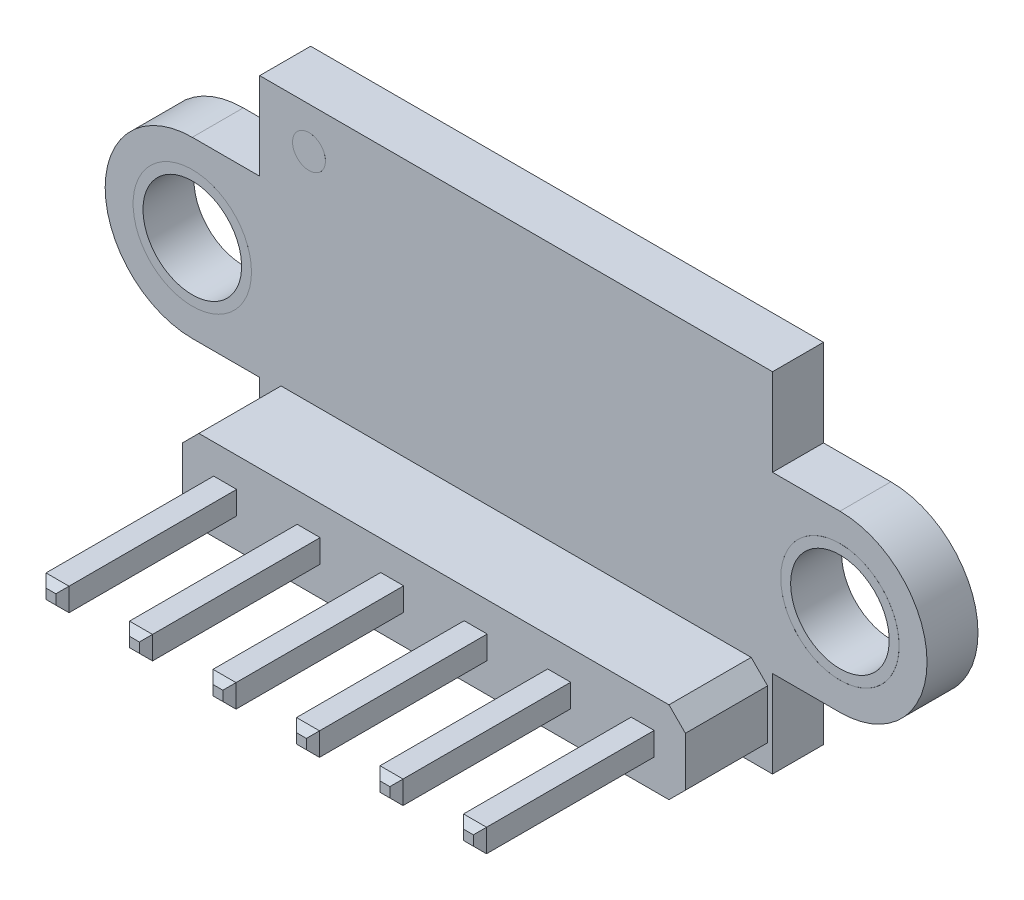
from build123d import *

# Parameters (mm, degrees)
SKETCH1_W                       = 15.6
SKETCH1_H                       = 10.6
BOSS_EXTRUDE1_DEPTH             = 0.775
SKETCH2_R                       = 1.5
BOSS_EXTRUDE2_DEPTH             = 0.775
BOSS_EXTRUDE9_START             = 0.0001
SKETCH9_R                       = 1.8
SKETCH9_R_2                     = 1.5
SKETCH9_R_3                     = 0.5
BOSS_EXTRUDE9_DEPTH             = 0.0001
SKIZZE1_R                       = 0.5
SCHNITT_LINEAR_AUSTRAGEN1_DEPTH = 14.665387298
SKETCH3_W                       = 15.3
SKETCH3_H                       = 2.5
BOSS_EXTRUDE3_DEPTH             = 2.5
CHAMFER1_SIZE                   = 0.5
BOSS_EXTRUDE4_START             = -5.35
SKETCH4_W                       = 0.7
SKETCH4_H                       = 0.7
BOSS_EXTRUDE4_DEPTH             = 10.65
CHAMFER2_SIZE                   = 0.2
SKETCH6_W                       = 6.43
SKETCH6_H                       = 3.05
BOSS_EXTRUDE6_DEPTH             = 1.2
SKETCH8_R                       = 0.15
SKETCH8_R_2                     = 0.05
CUT_EXTRUDE1_DEPTH              = 0.01
SKETCH5_W                       = 6.83
SKETCH5_H                       = 3.45
SKETCH5_W_2                     = 6.63
SKETCH5_H_2                     = 3.25
SKETCH5_W_3                     = 0.8
SKETCH5_H_3                     = 0.083116884
SKETCH5_H_4                     = 0.083116883
INSCRI_ES_DEPTH                 = 0.0001


with BuildPart() as part:
    # Sketch1 → Boss-Extrude1 (new, symmetric)
    with BuildSketch(Plane.XY):
        Rectangle(SKETCH1_W, SKETCH1_H)
    extrude(amount=BOSS_EXTRUDE1_DEPTH, both=True)

    # Sketch2 → Boss-Extrude2 (add, symmetric)
    # profile 1 of 2: a face of its own
    with BuildSketch(Plane.XY):
        with BuildLine():
            Line((-9.85, 2.65), (-7.8, 2.65))
            Line((-7.8, 2.65), (-7.8, -2.65))
            Line((-7.8, -2.65), (-9.85, -2.65))
            ThreePointArc((-9.85, -2.65), (-12.5, 0), (-9.85, 2.65))
        make_face()
        with Locations(Location((-9.85, 0, 0), (0, 0, 180))):
            Circle(SKETCH2_R, mode=Mode.SUBTRACT)
    # profile 2 of 2: a face of its own
    with BuildSketch(Plane.XY):
        with BuildLine():
            Line((9.85, -2.65), (7.8, -2.65))
            Line((7.8, -2.65), (7.8, 2.65))
            Line((7.8, 2.65), (9.85, 2.65))
            ThreePointArc((9.85, 2.65), (12.5, 0), (9.85, -2.65))
        make_face()
        with Locations(Location((9.85, 0, 0), (0, 0, 180))):
            Circle(SKETCH2_R, mode=Mode.SUBTRACT)
    extrude(amount=BOSS_EXTRUDE2_DEPTH, both=True)

    # Sketch9 → Boss-Extrude9 (add)
    # profile 1 of 3: a face of its own
    with BuildSketch(Plane(origin=(0, 0, -0.775), x_dir=(-1, 0, 0), z_dir=(0, 0, -1)).offset(BOSS_EXTRUDE9_START)):
        with Locations(Location((-9.85, 0, 0), (0, 0, 180))):
            Circle(SKETCH9_R)
        with Locations((-9.85, 0)):
            Circle(SKETCH9_R_2, mode=Mode.SUBTRACT)
    # profile 2 of 3: a face of its own
    with BuildSketch(Plane(origin=(0, 0, -0.775), x_dir=(-1, 0, 0), z_dir=(0, 0, -1)).offset(BOSS_EXTRUDE9_START)):
        with Locations(Location((9.85, 0, 0), (0, 0, 180))):
            Circle(SKETCH9_R)
        with Locations((9.85, 0)):
            Circle(SKETCH9_R_2, mode=Mode.SUBTRACT)
    # profile 3 of 3: a face of its own
    with BuildSketch(Plane(origin=(0, 0, -0.775), x_dir=(-1, 0, 0), z_dir=(0, 0, -1)).offset(BOSS_EXTRUDE9_START)):
        with Locations(Location((6.3, 4.05, 0), (0, 0, 180))):
            Circle(SKETCH9_R_3)
    boss_extrude9 = extrude(amount=-BOSS_EXTRUDE9_DEPTH)

    # Mirror4: Boss-Extrude9 across plane
    add(boss_extrude9.mirror(Plane.XY))

    # Skizze1 → Schnitt-Linear austragen1 (cut, through all)
    with BuildSketch(Plane.XY.offset(0.775)):
        with Locations((-6.35, -3.8)):
            Circle(SKIZZE1_R)
        with Locations((-3.81, -3.8)):
            Circle(SKIZZE1_R)
        with Locations((-1.27, -3.8)):
            Circle(SKIZZE1_R)
        with Locations((1.27, -3.8)):
            Circle(SKIZZE1_R)
        with Locations((3.81, -3.8)):
            Circle(SKIZZE1_R)
        with Locations((6.35, -3.8)):
            Circle(SKIZZE1_R)
    extrude(amount=-SCHNITT_LINEAR_AUSTRAGEN1_DEPTH, mode=Mode.SUBTRACT)

    # Sketch3 → Boss-Extrude3 (add)
    with BuildSketch(Plane.XY.offset(0.775)):
        with Locations((0, -3.8)):
            Rectangle(SKETCH3_W, SKETCH3_H)
    extrude(amount=BOSS_EXTRUDE3_DEPTH)

    # Chamfer1
    chamfer1_edges = [part.edges().sort_by_distance(p)[0] for p in [
        (-7.65, -2.55, 2.025),
        (-7.65, -5.05, 2.025),
        (7.65, -5.05, 2.025),
        (7.65, -2.55, 2.025),
    ]]
    chamfer(chamfer1_edges, length=CHAMFER1_SIZE)

    # Sketch4 → Boss-Extrude4 (add)
    with BuildSketch(Plane.XY.offset(3.275).offset(BOSS_EXTRUDE4_START)):
        with Locations((-3.81, -3.8)):
            Rectangle(SKETCH4_W, SKETCH4_H)
        with Locations((-6.35, -3.8)):
            Rectangle(SKETCH4_W, SKETCH4_H)
        with Locations((-1.27, -3.8)):
            Rectangle(SKETCH4_W, SKETCH4_H)
        with Locations((1.27, -3.8)):
            Rectangle(SKETCH4_W, SKETCH4_H)
        with Locations((3.81, -3.8)):
            Rectangle(SKETCH4_W, SKETCH4_H)
        with Locations((6.35, -3.8)):
            Rectangle(SKETCH4_W, SKETCH4_H)
    extrude(amount=BOSS_EXTRUDE4_DEPTH)

    # Chamfer2
    chamfer2_edges = [part.edges().sort_by_distance(p)[0] for p in [
        (-6.35, -3.45, 8.575),
        (-6.7, -3.8, 8.575),
        (-6.35, -4.15, 8.575),
        (-6, -3.8, 8.575),
        (-6.7, -3.8, -2.075),
        (-6.35, -3.45, -2.075),
        (-6, -3.8, -2.075),
        (-6.35, -4.15, -2.075),
        (-3.81, -3.45, 8.575),
        (-4.16, -3.8, 8.575),
        (-3.81, -4.15, 8.575),
        (-3.46, -3.8, 8.575),
        (-4.16, -3.8, -2.075),
        (-3.81, -3.45, -2.075),
        (-3.46, -3.8, -2.075),
        (-3.81, -4.15, -2.075),
        (-1.27, -3.45, 8.575),
        (-1.62, -3.8, 8.575),
        (-1.27, -4.15, 8.575),
        (-0.92, -3.8, 8.575),
        (-1.62, -3.8, -2.075),
        (-1.27, -3.45, -2.075),
        (-0.92, -3.8, -2.075),
        (-1.27, -4.15, -2.075),
        (1.27, -3.45, 8.575),
        (0.92, -3.8, 8.575),
        (1.27, -4.15, 8.575),
        (1.62, -3.8, 8.575),
        (0.92, -3.8, -2.075),
        (1.27, -3.45, -2.075),
        (1.62, -3.8, -2.075),
        (1.27, -4.15, -2.075),
        (3.81, -3.45, 8.575),
        (3.46, -3.8, 8.575),
        (3.81, -4.15, 8.575),
        (4.16, -3.8, 8.575),
        (3.46, -3.8, -2.075),
        (3.81, -3.45, -2.075),
        (4.16, -3.8, -2.075),
        (3.81, -4.15, -2.075),
        (6.35, -3.45, 8.575),
        (6, -3.8, 8.575),
        (6.35, -4.15, 8.575),
        (6.7, -3.8, 8.575),
        (6, -3.8, -2.075),
        (6.35, -3.45, -2.075),
        (6.7, -3.8, -2.075),
        (6.35, -4.15, -2.075),
    ]]
    chamfer(chamfer2_edges, length=CHAMFER2_SIZE)

    # Sketch6 → Boss-Extrude6 (add)
    with BuildSketch(Plane(origin=(0, 0, -0.775), x_dir=(-1, 0, 0), z_dir=(0, 0, -1))):
        with Locations((0, 1.775)):
            Rectangle(SKETCH6_W, SKETCH6_H)
    extrude(amount=BOSS_EXTRUDE6_DEPTH)

    # Sketch8 → Cut-Extrude1 (cut)
    with BuildSketch(Plane(origin=(0, 0, -1.975), x_dir=(-1, 0, 0), z_dir=(0, 0, -1))):
        with Locations((-2.565, 1.775)):
            Circle(SKETCH8_R)
        with Locations((2.665, 1.775)):
            Circle(SKETCH8_R_2)
    extrude(amount=-CUT_EXTRUDE1_DEPTH, mode=Mode.SUBTRACT)

    # Sketch5 → Inscrições (add)
    # profile 1 of 27: a face of its own
    with BuildSketch(Plane(origin=(0, 0, -0.775), x_dir=(-1, 0, 0), z_dir=(0, 0, -1))):
        with Locations((0, 1.775)):
            Rectangle(SKETCH5_W, SKETCH5_H)
        with Locations((0, 1.775)):
            Rectangle(SKETCH5_W_2, SKETCH5_H_2, mode=Mode.SUBTRACT)
    # profile 2 of 27: a face of its own
    with BuildSketch(Plane(origin=(0, 0, -0.775), x_dir=(-1, 0, 0), z_dir=(0, 0, -1))):
        Polygon((-2.376133045, 4.896036452), (-2.304017661, 4.896036452), (-2.054017661, 4.304990779), (-1.804017661, 4.896036452), (-1.731902276, 4.896036452), (-2.049209968, 4.146036452), (-2.058825353, 4.146036452), align=None)
    # profile 3 of 27: a face of its own
    with BuildSketch(Plane(origin=(0, 0, -0.775), x_dir=(-1, 0, 0), z_dir=(0, 0, -1))):
        Polygon((-1.597286891, 4.896036452), (-1.529979199, 4.896036452), (-1.529979199, 4.222959529), (-1.241517661, 4.222959529), (-1.241517661, 4.146036452), (-1.597286891, 4.146036452), align=None)
    # profile 4 of 27: a face of its own
    with BuildSketch(Plane(origin=(0, 0, -0.775), x_dir=(-1, 0, 0), z_dir=(0, 0, -1))):
        with BuildLine():
            Line((-0.712671507, 4.896036452), (-0.712671507, 4.819113375))
            Line((-0.712671507, 4.819113375), (-0.96777968, 4.819113375))
            Line((-0.96777968, 4.819113375), (-1.008194343, 4.62184775))
            add(Edge.make_bspline(
                [(-1.008194343, 4.62184775), (-1.000253799, 4.624039951), (-0.98487025, 4.628286994), (-0.962164565, 4.633002516), (-0.940609093, 4.635845111), (-0.926621514, 4.636233249), (-0.919852997, 4.636421067)],
                knots=[0, 0, 0, 0, 1.100273476, 2.13160584, 3.095893838, 4, 4, 4, 4], degree=3))
            add(Edge.make_bspline(
                [(-0.919852997, 4.636421067), (-0.91147791, 4.636239795), (-0.895010396, 4.635883369), (-0.870916336, 4.63246083), (-0.847916431, 4.627073706), (-0.82605878, 4.61954788), (-0.805302947, 4.609924365), (-0.785839899, 4.59790295), (-0.767377489, 4.583860093), (-0.750246933, 4.567714733), (-0.73470601, 4.549945815), (-0.721041869, 4.530840557), (-0.7094356, 4.51058463), (-0.700101152, 4.488984499), (-0.692647366, 4.466278966), (-0.687686225, 4.442229127), (-0.684382644, 4.417061673), (-0.684013561, 4.399853551), (-0.683825353, 4.391078519)],
                knots=[0, 0, 0, 0, 1.052922333, 2.070308379, 3.05430497, 4.020497103, 4.973039431, 5.925935799, 6.892292201, 7.88610001, 8.88166317, 9.857072816, 10.836096531, 11.812156883, 12.81219415, 13.836441305, 14.89672472, 16, 16, 16, 16], degree=3))
            add(Edge.make_bspline(
                [(-0.683825353, 4.391078519), (-0.683967869, 4.384966615), (-0.684250975, 4.372825403), (-0.685690673, 4.354794503), (-0.688462612, 4.337145325), (-0.692184267, 4.319875526), (-0.697014785, 4.303017804), (-0.702862439, 4.286523905), (-0.710018731, 4.270496489), (-0.717868311, 4.254783904), (-0.726706843, 4.239741367), (-0.736516523, 4.225673727), (-0.746880556, 4.212369953), (-0.758032282, 4.199972724), (-0.770075352, 4.188563506), (-0.782863917, 4.178074589), (-0.796295928, 4.168328589), (-0.810579194, 4.159721119), (-0.82539544, 4.151800485), (-0.84095863, 4.145302585), (-0.856914494, 4.139493186), (-0.873492682, 4.134862573), (-0.890655642, 4.131234168), (-0.908431665, 4.128769754), (-0.926727523, 4.126974803), (-0.939129311, 4.126862441), (-0.945393862, 4.126805683)],
                knots=[0, 0, 0, 0, 1.056347294, 2.098418968, 3.122841568, 4.141288669, 5.149314143, 6.15115421, 7.162517403, 8.180376062, 9.185164535, 10.17417709, 11.141909838, 12.097768115, 13.052685741, 14.0056014, 14.954263652, 15.917497458, 16.885230207, 17.854509472, 18.828990115, 19.81800267, 20.826176721, 21.857883937, 22.917946725, 24, 24, 24, 24], degree=3))
            add(Edge.make_bspline(
                [(-0.945393862, 4.126805683), (-0.952866901, 4.126953719), (-0.967569222, 4.127244964), (-0.989109344, 4.130291782), (-1.009833902, 4.134655479), (-1.029576066, 4.141220394), (-1.048512766, 4.149446243), (-1.066389062, 4.159842565), (-1.083661729, 4.171623802), (-1.099628594, 4.185526734), (-1.114447761, 4.200722952), (-1.127713441, 4.217213875), (-1.139527779, 4.234727327), (-1.149701582, 4.25334836), (-1.15837973, 4.273028045), (-1.165197227, 4.293840117), (-1.170699732, 4.315675832), (-1.173027608, 4.330708727), (-1.174209968, 4.338344144)],
                knots=[0, 0, 0, 0, 1.0467383, 2.05933395, 3.04377827, 4.011590433, 4.970194871, 5.932262533, 6.905835911, 7.896367577, 8.894135286, 9.877477877, 10.858688626, 11.851381753, 12.8477658, 13.868841284, 14.917554742, 16, 16, 16, 16], degree=3))
            Line((-1.174209968, 4.338344144), (-1.106902276, 4.338344144))
            add(Edge.make_bspline(
                [(-1.106902276, 4.338344144), (-1.105246156, 4.331192047), (-1.102063003, 4.31744532), (-1.095076057, 4.298131461), (-1.086533369, 4.280920199), (-1.076375295, 4.265583859), (-1.064257431, 4.252210503), (-1.050429696, 4.240292561), (-1.034926613, 4.229540748), (-1.017699492, 4.220578726), (-0.999525261, 4.212935422), (-0.980503716, 4.207845773), (-0.961152784, 4.20426701), (-0.948064562, 4.203908776), (-0.941487612, 4.20372876)],
                knots=[0, 0, 0, 0, 1.136247022, 2.183929868, 3.172523383, 4.106158343, 5.02341133, 5.958108904, 6.928429099, 7.938127109, 8.96079061, 9.975095812, 10.982467395, 12, 12, 12, 12], degree=3))
            add(Edge.make_bspline(
                [(-0.941487612, 4.20372876), (-0.935067946, 4.203904641), (-0.92242757, 4.204250952), (-0.90382513, 4.206916454), (-0.885865228, 4.211021648), (-0.86872508, 4.217165188), (-0.85210475, 4.224631914), (-0.836424657, 4.234213716), (-0.821231183, 4.245240863), (-0.806996583, 4.257874426), (-0.793959558, 4.271796504), (-0.782440389, 4.286684516), (-0.772845336, 4.302566698), (-0.764759456, 4.319168088), (-0.758619463, 4.336670636), (-0.754239253, 4.354992316), (-0.751667169, 4.374178383), (-0.751313345, 4.387264664), (-0.751133045, 4.393933087)],
                knots=[0, 0, 0, 0, 1.027316725, 2.022795036, 3.002884548, 3.971462791, 4.93288096, 5.914575861, 6.907176829, 7.935150275, 8.956128384, 9.956726525, 10.942570165, 11.921478529, 12.907843606, 13.90538589, 14.932640048, 16, 16, 16, 16], degree=3))
            add(Edge.make_bspline(
                [(-0.751133045, 4.393933087), (-0.751274148, 4.399949319), (-0.751550336, 4.411725238), (-0.753806887, 4.428953639), (-0.757731953, 4.445255006), (-0.763179927, 4.460708056), (-0.770096964, 4.475327365), (-0.778549746, 4.489128021), (-0.788696902, 4.501928128), (-0.800288021, 4.513733675), (-0.812986173, 4.524629005), (-0.827009832, 4.533917024), (-0.842065531, 4.54173072), (-0.857971873, 4.548473863), (-0.875107209, 4.55331688), (-0.893132201, 4.556952855), (-0.912241496, 4.559056147), (-0.925306643, 4.559347981), (-0.932022468, 4.55949799)],
                knots=[0, 0, 0, 0, 1.045622112, 2.046656509, 3.013763289, 3.955457236, 4.890082067, 5.820317437, 6.762574623, 7.722996705, 8.69280354, 9.665887285, 10.63943826, 11.638615906, 12.663482002, 13.728887084, 14.832589034, 16, 16, 16, 16], degree=3))
            add(Edge.make_bspline(
                [(-0.932022468, 4.55949799), (-0.93783581, 4.559373578), (-0.949838886, 4.559116698), (-0.968250921, 4.557225306), (-0.987599147, 4.554174028), (-1.007809396, 4.549976975), (-1.028942362, 4.544484602), (-1.050953448, 4.537902923), (-1.073888934, 4.530033923), (-1.089342732, 4.524091306), (-1.097286891, 4.521036452)],
                knots=[0, 0, 0, 0, 0.817624296, 1.688186739, 2.600797293, 3.572016777, 4.590301741, 5.671205678, 6.80286297, 8, 8, 8, 8], degree=3))
            Line((-1.097286891, 4.521036452), (-1.020363814, 4.896036452))
            Line((-1.020363814, 4.896036452), (-0.712671507, 4.896036452))
        make_face()
    # profile 5 of 27: a face of its own
    with BuildSketch(Plane(origin=(0, 0, -0.775), x_dir=(-1, 0, 0), z_dir=(0, 0, -1))):
        with BuildLine():
            Line((-0.51074843, 4.722959529), (-0.578056122, 4.722959529))
            add(Edge.make_bspline(
                [(-0.578056122, 4.722959529), (-0.576232647, 4.730509347), (-0.572667902, 4.745268623), (-0.565232708, 4.766355894), (-0.557132867, 4.786310934), (-0.547406631, 4.804760093), (-0.536797612, 4.822074143), (-0.524642743, 4.837860384), (-0.511502803, 4.852520305), (-0.496968885, 4.865530285), (-0.481727029, 4.877311227), (-0.465562467, 4.887355882), (-0.448800419, 4.895996772), (-0.431324747, 4.903115393), (-0.413083425, 4.908478005), (-0.394241363, 4.912368749), (-0.374749184, 4.914895417), (-0.361517558, 4.915142009), (-0.354798911, 4.915267221)],
                knots=[0, 0, 0, 0, 1.162005537, 2.271625781, 3.343758855, 4.383309926, 5.390229558, 6.379919256, 7.361854164, 8.333198761, 9.295911338, 10.242430842, 11.177959212, 12.116337295, 13.062827104, 14.020064771, 14.994644689, 16, 16, 16, 16], degree=3))
            add(Edge.make_bspline(
                [(-0.354798911, 4.915267221), (-0.345009752, 4.914971672), (-0.325644963, 4.91438702), (-0.297195739, 4.909048212), (-0.269761421, 4.900599969), (-0.243642296, 4.888927028), (-0.219381204, 4.874529747), (-0.197794878, 4.857394446), (-0.179175911, 4.837851738), (-0.163555687, 4.816266189), (-0.15132533, 4.793197151), (-0.142306822, 4.76945426), (-0.136816462, 4.745093838), (-0.136104914, 4.728645849), (-0.13574843, 4.720405442)],
                knots=[0, 0, 0, 0, 1.083050992, 2.142477498, 3.193116406, 4.255571735, 5.30263384, 6.308962982, 7.297363603, 8.282367274, 9.249857812, 10.179914175, 11.08814088, 12, 12, 12, 12], degree=3))
            add(Edge.make_bspline(
                [(-0.13574843, 4.720405442), (-0.135997771, 4.712475415), (-0.136485692, 4.696957582), (-0.140628629, 4.674302975), (-0.147600685, 4.652951204), (-0.157258492, 4.632812383), (-0.169760253, 4.614014203), (-0.184904402, 4.59651437), (-0.202797829, 4.580235264), (-0.216357602, 4.570909663), (-0.223338574, 4.566108567)],
                knots=[0, 0, 0, 0, 1.024540389, 2.004866551, 2.965041327, 3.920577974, 4.882998113, 5.874504559, 6.905732034, 8, 8, 8, 8], degree=3))
            add(Edge.make_bspline(
                [(-0.223338574, 4.566108567), (-0.215360341, 4.562256102), (-0.199553154, 4.554623254), (-0.178006611, 4.539654163), (-0.158447067, 4.52237066), (-0.147539127, 4.508882949), (-0.142058526, 4.502106163)],
                knots=[0, 0, 0, 0, 1.015518401, 2.012035669, 3.001164323, 4, 4, 4, 4], degree=3))
            add(Edge.make_bspline(
                [(-0.142058526, 4.502106163), (-0.138449667, 4.497165217), (-0.131291046, 4.487364235), (-0.12245486, 4.471606429), (-0.114438622, 4.455673967), (-0.108192146, 4.439139809), (-0.103354889, 4.422195591), (-0.099897168, 4.404812221), (-0.097749138, 4.386975502), (-0.097441519, 4.374908542), (-0.097286891, 4.368842942)],
                knots=[0, 0, 0, 0, 1.025084078, 2.033381695, 3.024893161, 4.013698104, 4.991890475, 5.976764909, 6.982997093, 8, 8, 8, 8], degree=3))
            add(Edge.make_bspline(
                [(-0.097286891, 4.368842942), (-0.09767143, 4.358340859), (-0.098438697, 4.337386116), (-0.105296713, 4.306427247), (-0.115928122, 4.276164639), (-0.131026037, 4.247220031), (-0.149426217, 4.220138521), (-0.171317073, 4.195907883), (-0.196449874, 4.175079611), (-0.224479656, 4.157677419), (-0.254847612, 4.143766436), (-0.287328096, 4.134111269), (-0.321453108, 4.127822841), (-0.344854672, 4.127148512), (-0.356752036, 4.126805683)],
                knots=[0, 0, 0, 0, 0.955779014, 1.907060117, 2.875433937, 3.871313158, 4.872415639, 5.851225146, 6.836215519, 7.83643374, 8.849228613, 9.86973379, 10.916971861, 12, 12, 12, 12], degree=3))
            add(Edge.make_bspline(
                [(-0.356752036, 4.126805683), (-0.364770457, 4.126991728), (-0.380548037, 4.127357804), (-0.403743072, 4.129860362), (-0.425883436, 4.134431077), (-0.446999064, 4.140581785), (-0.467108715, 4.148380016), (-0.486151023, 4.158091165), (-0.504243143, 4.169515059), (-0.521214347, 4.182786542), (-0.537062612, 4.197632543), (-0.551366767, 4.214316617), (-0.564365294, 4.232530346), (-0.575710145, 4.252485287), (-0.585918063, 4.273923556), (-0.594313983, 4.297119663), (-0.601703747, 4.321866239), (-0.60513949, 4.339111469), (-0.606902276, 4.347959529)],
                knots=[0, 0, 0, 0, 1.048658725, 2.063410685, 3.046034179, 4.001477787, 4.936774919, 5.862367409, 6.792675028, 7.730719943, 8.675894397, 9.627829632, 10.600096036, 11.597688215, 12.626045268, 13.701542398, 14.82072376, 16, 16, 16, 16], degree=3))
            Line((-0.606902276, 4.347959529), (-0.539594584, 4.347959529))
            add(Edge.make_bspline(
                [(-0.539594584, 4.347959529), (-0.537841021, 4.34218474), (-0.53443019, 4.330952275), (-0.528624269, 4.314786495), (-0.522009639, 4.299966912), (-0.514913662, 4.286384815), (-0.507461138, 4.273906443), (-0.499122226, 4.262861757), (-0.490514552, 4.252765642), (-0.484026119, 4.247077511), (-0.480850593, 4.244293663)],
                knots=[0, 0, 0, 0, 1.198163088, 2.33053128, 3.407730985, 4.417276592, 5.372219308, 6.28897303, 7.162600585, 8, 8, 8, 8], degree=3))
            add(Edge.make_bspline(
                [(-0.480850593, 4.244293663), (-0.476651327, 4.241056163), (-0.468265756, 4.234591157), (-0.454601135, 4.226340808), (-0.440230088, 4.219192016), (-0.424841229, 4.213731224), (-0.408766636, 4.20910744), (-0.391746486, 4.206081614), (-0.37393094, 4.204005578), (-0.361766419, 4.203822378), (-0.355550112, 4.20372876)],
                knots=[0, 0, 0, 0, 0.946170439, 1.889420265, 2.845303464, 3.807233317, 4.801018734, 5.828864929, 6.890507805, 8, 8, 8, 8], degree=3))
            add(Edge.make_bspline(
                [(-0.355550112, 4.20372876), (-0.348531505, 4.203860739), (-0.334807223, 4.204118814), (-0.314781182, 4.20649218), (-0.295729586, 4.209948697), (-0.277863959, 4.215287193), (-0.260950279, 4.22188309), (-0.24522564, 4.230164891), (-0.230483617, 4.239881617), (-0.21691303, 4.250925723), (-0.204710421, 4.263016043), (-0.19396624, 4.275661701), (-0.184832384, 4.288809379), (-0.177464474, 4.302531834), (-0.171646499, 4.31677224), (-0.167685813, 4.33157056), (-0.164931917, 4.346805689), (-0.164707643, 4.357161896), (-0.164594584, 4.362382606)],
                knots=[0, 0, 0, 0, 1.217147791, 2.380027433, 3.494444702, 4.572153297, 5.609568379, 6.639424714, 7.649109417, 8.668170816, 9.669597737, 10.625200337, 11.543417969, 12.441394052, 13.322311151, 14.205496177, 15.095365482, 16, 16, 16, 16], degree=3))
            add(Edge.make_bspline(
                [(-0.164594584, 4.362382606), (-0.164922505, 4.36937075), (-0.165576717, 4.383312266), (-0.170571413, 4.403823175), (-0.178786884, 4.423585334), (-0.190288136, 4.442261575), (-0.204288649, 4.459570697), (-0.220652558, 4.475014586), (-0.23951575, 4.487758177), (-0.25687715, 4.496562889), (-0.272255398, 4.502570834), (-0.285415838, 4.506572612), (-0.300149396, 4.509961252), (-0.316277899, 4.513113882), (-0.333922874, 4.515797028), (-0.353065111, 4.51803456), (-0.373708488, 4.519824926), (-0.387999452, 4.520624446), (-0.395363814, 4.521036452)],
                knots=[0, 0, 0, 0, 1.07054697, 2.135767047, 3.216561865, 4.33974944, 5.486079747, 6.621378074, 7.775625952, 8.963672916, 9.598146892, 10.304877434, 11.070270905, 11.915000392, 12.823868403, 13.805723172, 14.86925407, 16, 16, 16, 16], degree=3))
            Line((-0.395363814, 4.521036452), (-0.395363814, 4.597959529))
            add(Edge.make_bspline(
                [(-0.395363814, 4.597959529), (-0.386084993, 4.598116987), (-0.367910062, 4.598425408), (-0.341361282, 4.602155696), (-0.315974144, 4.607315831), (-0.292311271, 4.6152198), (-0.270743689, 4.624399864), (-0.252032346, 4.63508248), (-0.236439386, 4.64695707), (-0.224040585, 4.660206914), (-0.214712893, 4.674417282), (-0.207892865, 4.689227994), (-0.203864223, 4.704768864), (-0.203326438, 4.715374865), (-0.203056122, 4.720705923)],
                knots=[0, 0, 0, 0, 1.321986639, 2.589447074, 3.816329219, 5.01088745, 6.139805852, 7.153945165, 8.075214402, 8.924034688, 9.728124013, 10.488707548, 11.240355623, 12, 12, 12, 12], degree=3))
            add(Edge.make_bspline(
                [(-0.203056122, 4.720705923), (-0.203144924, 4.724622583), (-0.203321592, 4.732414591), (-0.205549581, 4.743798535), (-0.208897589, 4.754834452), (-0.213500389, 4.765475411), (-0.219661145, 4.775647613), (-0.227033857, 4.78543778), (-0.235812735, 4.794790019), (-0.245872474, 4.80350723), (-0.256675004, 4.811814924), (-0.268514241, 4.818867846), (-0.281033214, 4.824898931), (-0.294245783, 4.829872395), (-0.308194825, 4.833613671), (-0.322814802, 4.836299923), (-0.338133591, 4.83797942), (-0.348584677, 4.838221224), (-0.353897468, 4.838344144)],
                knots=[0, 0, 0, 0, 0.884392785, 1.759457502, 2.611959086, 3.489218968, 4.37281399, 5.2945488, 6.255912374, 7.266815255, 8.301784654, 9.332968512, 10.37626691, 11.440494194, 12.520033166, 13.637162961, 14.798855837, 16, 16, 16, 16], degree=3))
            add(Edge.make_bspline(
                [(-0.353897468, 4.838344144), (-0.362437111, 4.838045995), (-0.379117021, 4.837463641), (-0.403163074, 4.832362995), (-0.425517217, 4.824224834), (-0.442604074, 4.814510616), (-0.455221769, 4.804921237), (-0.464238256, 4.79654644), (-0.473092651, 4.787239407), (-0.481202439, 4.776426898), (-0.489404005, 4.764841157), (-0.496870697, 4.751893225), (-0.504126345, 4.737920855), (-0.50849832, 4.728043219), (-0.51074843, 4.722959529)],
                knots=[0, 0, 0, 0, 1.472543308, 2.876219568, 4.221790263, 5.565193594, 6.249813518, 6.953379497, 7.687249741, 8.463570142, 9.283606569, 10.136032583, 11.040678096, 12, 12, 12, 12], degree=3))
        make_face()
    # profile 6 of 27: a face of its own
    with BuildSketch(Plane(origin=(0, 0, -0.775), x_dir=(-1, 0, 0), z_dir=(0, 0, -1))):
        Polygon((0.037328493, 4.896036452), (0.104636186, 4.896036452), (0.104636186, 4.222959529), (0.393097724, 4.222959529), (0.393097724, 4.146036452), (0.037328493, 4.146036452), align=None)
    # profile 7 of 27: a face of its own
    with BuildSketch(Plane(origin=(0, 0, -0.775), x_dir=(-1, 0, 0), z_dir=(0, 0, -1))):
        with BuildLine():
            Line((0.921943878, 4.896036452), (0.921943878, 4.819113375))
            Line((0.921943878, 4.819113375), (0.666835705, 4.819113375))
            Line((0.666835705, 4.819113375), (0.626421041, 4.62184775))
            add(Edge.make_bspline(
                [(0.626421041, 4.62184775), (0.634361586, 4.624039951), (0.649745135, 4.628286994), (0.672450819, 4.633002516), (0.694006292, 4.635845111), (0.707993871, 4.636233249), (0.714762388, 4.636421067)],
                knots=[0, 0, 0, 0, 1.100273476, 2.13160584, 3.095893838, 4, 4, 4, 4], degree=3))
            add(Edge.make_bspline(
                [(0.714762388, 4.636421067), (0.723137475, 4.636239795), (0.739604988, 4.635883369), (0.763699048, 4.63246083), (0.786698954, 4.627073706), (0.808556605, 4.61954788), (0.829312437, 4.609924365), (0.848775486, 4.59790295), (0.867237896, 4.583860093), (0.884368452, 4.567714733), (0.899909375, 4.549945815), (0.913573516, 4.530840557), (0.925179785, 4.51058463), (0.934514232, 4.488984499), (0.941968018, 4.466278966), (0.94692916, 4.442229127), (0.950232741, 4.417061673), (0.950601823, 4.399853551), (0.950790032, 4.391078519)],
                knots=[0, 0, 0, 0, 1.052922333, 2.070308379, 3.05430497, 4.020497103, 4.973039431, 5.925935799, 6.892292201, 7.88610001, 8.88166317, 9.857072816, 10.836096531, 11.812156883, 12.81219415, 13.836441305, 14.89672472, 16, 16, 16, 16], degree=3))
            add(Edge.make_bspline(
                [(0.950790032, 4.391078519), (0.950647516, 4.384966615), (0.950364409, 4.372825403), (0.948924712, 4.354794503), (0.946152773, 4.337145325), (0.942431118, 4.319875526), (0.9376006, 4.303017804), (0.931752945, 4.286523905), (0.924596654, 4.270496489), (0.916747073, 4.254783904), (0.907908542, 4.239741367), (0.898098862, 4.225673727), (0.887734828, 4.212369953), (0.876583103, 4.199972724), (0.864540032, 4.188563506), (0.851751468, 4.178074589), (0.838319457, 4.168328589), (0.824036191, 4.159721119), (0.809219944, 4.151800485), (0.793656755, 4.145302585), (0.77770089, 4.139493186), (0.761122703, 4.134862573), (0.743959743, 4.131234168), (0.72618372, 4.128769754), (0.707887862, 4.126974803), (0.695486073, 4.126862441), (0.689221522, 4.126805683)],
                knots=[0, 0, 0, 0, 1.056347294, 2.098418968, 3.122841568, 4.141288669, 5.149314143, 6.15115421, 7.162517403, 8.180376062, 9.185164535, 10.17417709, 11.141909838, 12.097768115, 13.052685741, 14.0056014, 14.954263652, 15.917497458, 16.885230207, 17.854509472, 18.828990115, 19.81800267, 20.826176721, 21.857883937, 22.917946725, 24, 24, 24, 24], degree=3))
            add(Edge.make_bspline(
                [(0.689221522, 4.126805683), (0.681748483, 4.126953719), (0.667046163, 4.127244964), (0.645506041, 4.130291782), (0.624781483, 4.134655479), (0.605039318, 4.141220394), (0.586102619, 4.149446243), (0.568226322, 4.159842565), (0.550953656, 4.171623802), (0.534986791, 4.185526734), (0.520167624, 4.200722952), (0.506901943, 4.217213875), (0.495087605, 4.234727327), (0.484913802, 4.25334836), (0.476235655, 4.273028045), (0.469418157, 4.293840117), (0.463915653, 4.315675832), (0.461587777, 4.330708727), (0.460405416, 4.338344144)],
                knots=[0, 0, 0, 0, 1.0467383, 2.05933395, 3.04377827, 4.011590433, 4.970194871, 5.932262533, 6.905835911, 7.896367577, 8.894135286, 9.877477877, 10.858688626, 11.851381753, 12.8477658, 13.868841284, 14.917554742, 16, 16, 16, 16], degree=3))
            Line((0.460405416, 4.338344144), (0.527713109, 4.338344144))
            add(Edge.make_bspline(
                [(0.527713109, 4.338344144), (0.529369228, 4.331192047), (0.532552382, 4.31744532), (0.539539328, 4.298131461), (0.548082015, 4.280920199), (0.55824009, 4.265583859), (0.570357954, 4.252210503), (0.584185689, 4.240292561), (0.599688772, 4.229540748), (0.616915893, 4.220578726), (0.635090124, 4.212935422), (0.654111669, 4.207845773), (0.6734626, 4.20426701), (0.686550823, 4.203908776), (0.693127772, 4.20372876)],
                knots=[0, 0, 0, 0, 1.136247022, 2.183929868, 3.172523383, 4.106158343, 5.02341133, 5.958108904, 6.928429099, 7.938127109, 8.96079061, 9.975095812, 10.982467395, 12, 12, 12, 12], degree=3))
            add(Edge.make_bspline(
                [(0.693127772, 4.20372876), (0.699547439, 4.203904641), (0.712187815, 4.204250952), (0.730790255, 4.206916454), (0.748750157, 4.211021648), (0.765890304, 4.217165188), (0.782510634, 4.224631914), (0.798190728, 4.234213716), (0.813384202, 4.245240863), (0.827618802, 4.257874426), (0.840655827, 4.271796504), (0.852174995, 4.286684516), (0.861770048, 4.302566698), (0.869855929, 4.319168088), (0.875995921, 4.336670636), (0.880376132, 4.354992316), (0.882948216, 4.374178383), (0.88330204, 4.387264664), (0.883482339, 4.393933087)],
                knots=[0, 0, 0, 0, 1.027316725, 2.022795036, 3.002884548, 3.971462791, 4.93288096, 5.914575861, 6.907176829, 7.935150275, 8.956128384, 9.956726525, 10.942570165, 11.921478529, 12.907843606, 13.90538589, 14.932640048, 16, 16, 16, 16], degree=3))
            add(Edge.make_bspline(
                [(0.883482339, 4.393933087), (0.883341237, 4.399949319), (0.883065048, 4.411725238), (0.880808497, 4.428953639), (0.876883432, 4.445255006), (0.871435458, 4.460708056), (0.86451842, 4.475327365), (0.856065639, 4.489128021), (0.845918482, 4.501928128), (0.834327363, 4.513733675), (0.821629212, 4.524629005), (0.807605553, 4.533917024), (0.792549854, 4.54173072), (0.776643511, 4.548473863), (0.759508176, 4.55331688), (0.741483183, 4.556952855), (0.722373889, 4.559056147), (0.709308741, 4.559347981), (0.702592916, 4.55949799)],
                knots=[0, 0, 0, 0, 1.045622112, 2.046656509, 3.013763289, 3.955457236, 4.890082067, 5.820317437, 6.762574623, 7.722996705, 8.69280354, 9.665887285, 10.63943826, 11.638615906, 12.663482002, 13.728887084, 14.832589034, 16, 16, 16, 16], degree=3))
            add(Edge.make_bspline(
                [(0.702592916, 4.55949799), (0.696779574, 4.559373578), (0.684776498, 4.559116698), (0.666364464, 4.557225306), (0.647016238, 4.554174028), (0.626805989, 4.549976975), (0.605673023, 4.544484602), (0.583661937, 4.537902923), (0.560726451, 4.530033923), (0.545272653, 4.524091306), (0.537328493, 4.521036452)],
                knots=[0, 0, 0, 0, 0.817624296, 1.688186739, 2.600797293, 3.572016777, 4.590301741, 5.671205678, 6.80286297, 8, 8, 8, 8], degree=3))
            Line((0.537328493, 4.521036452), (0.61425157, 4.896036452))
            Line((0.61425157, 4.896036452), (0.921943878, 4.896036452))
        make_face()
    # profile 8 of 27: a face of its own
    with BuildSketch(Plane(origin=(0, 0, -0.775), x_dir=(-1, 0, 0), z_dir=(0, 0, -1))):
        with BuildLine():
            Line((1.787328493, 4.75841626), (1.728434263, 4.713344144))
            add(Edge.make_bspline(
                [(1.728434263, 4.713344144), (1.724233001, 4.718351138), (1.715887119, 4.72829762), (1.702460147, 4.742264665), (1.688466938, 4.755350078), (1.673912841, 4.767616195), (1.658535887, 4.778634074), (1.642708573, 4.788977881), (1.626166134, 4.798249539), (1.603290763, 4.809491608), (1.573366224, 4.821222927), (1.535695901, 4.831059334), (1.496372094, 4.837321014), (1.469544037, 4.837999194), (1.455898205, 4.838344144)],
                knots=[0, 0, 0, 0, 0.757959112, 1.505699292, 2.245454638, 2.979532153, 3.711538275, 4.438200793, 5.171680507, 5.909471876, 7.393775596, 8.890124382, 10.418191784, 12, 12, 12, 12], degree=3))
            add(Edge.make_bspline(
                [(1.455898205, 4.838344144), (1.448380355, 4.838257581), (1.433414428, 4.838085257), (1.411204041, 4.835811873), (1.389408387, 4.832616614), (1.368041644, 4.827875473), (1.34713101, 4.821881341), (1.326539781, 4.814718752), (1.306566081, 4.805857001), (1.286933602, 4.796062374), (1.268123771, 4.78499935), (1.250326261, 4.772932203), (1.233605982, 4.759995968), (1.217949708, 4.746142159), (1.203341433, 4.731433168), (1.189887009, 4.715712238), (1.177632993, 4.699029629), (1.166336487, 4.681605327), (1.156219473, 4.663490086), (1.147748785, 4.644616857), (1.140247687, 4.625308835), (1.134312135, 4.605347872), (1.129614024, 4.584874422), (1.126372382, 4.563833539), (1.124124853, 4.542269179), (1.123953386, 4.527652898), (1.123866955, 4.52028525)],
                knots=[0, 0, 0, 0, 1.054917814, 2.100044995, 3.131103042, 4.146048494, 5.169673617, 6.183595914, 7.203665975, 8.234915748, 9.262203917, 10.264457458, 11.251630812, 12.227803204, 13.197192746, 14.159520551, 15.12972552, 16.100847026, 17.073214652, 18.039054194, 19.002613845, 19.979014051, 20.95965708, 21.949030935, 22.966165397, 24, 24, 24, 24], degree=3))
            add(Edge.make_bspline(
                [(1.123866955, 4.52028525), (1.124137345, 4.509199967), (1.124668219, 4.487435485), (1.129392862, 4.455556068), (1.136572525, 4.425015924), (1.147333005, 4.396005958), (1.160601373, 4.368168452), (1.177367219, 4.341974412), (1.196785048, 4.317028006), (1.219129567, 4.293918802), (1.243645099, 4.272808718), (1.269948222, 4.254219308), (1.297973427, 4.238723262), (1.327411276, 4.225828416), (1.358488301, 4.21591626), (1.391148615, 4.208938234), (1.425321186, 4.204386338), (1.448671772, 4.203950548), (1.460555657, 4.20372876)],
                knots=[0, 0, 0, 0, 1.029171465, 2.020641659, 2.987623507, 3.938342917, 4.889210282, 5.84687017, 6.821220943, 7.821438502, 8.827599549, 9.822697543, 10.807740252, 11.797342354, 12.80366471, 13.83203677, 14.896651826, 16, 16, 16, 16], degree=3))
            add(Edge.make_bspline(
                [(1.460555657, 4.20372876), (1.47364909, 4.204090641), (1.499420099, 4.20480291), (1.537213248, 4.210837035), (1.57339234, 4.220620874), (1.607959323, 4.234313286), (1.640816747, 4.252112991), (1.672016032, 4.273691108), (1.701583511, 4.299252893), (1.719363072, 4.318770706), (1.728434263, 4.32872876)],
                knots=[0, 0, 0, 0, 1.028121516, 2.023589091, 2.998037872, 3.967518031, 4.937445131, 5.927275754, 6.942489185, 8, 8, 8, 8], degree=3))
            Line((1.728434263, 4.32872876), (1.787328493, 4.284107365))
            add(Edge.make_bspline(
                [(1.787328493, 4.284107365), (1.782588898, 4.277991983), (1.773132411, 4.26579051), (1.757819979, 4.248589429), (1.741689129, 4.232409993), (1.724620048, 4.217382646), (1.706809093, 4.203206689), (1.687936455, 4.190284868), (1.668250233, 4.178436821), (1.647817131, 4.167588195), (1.626658857, 4.15796307), (1.604800763, 4.149722977), (1.582337069, 4.142624787), (1.559266745, 4.136785086), (1.53554194, 4.132226996), (1.511248267, 4.129179923), (1.486333294, 4.12709237), (1.469524418, 4.126902102), (1.461006378, 4.126805683)],
                knots=[0, 0, 0, 0, 0.986787822, 1.968848986, 2.935600012, 3.899624008, 4.868462664, 5.837806735, 6.815139263, 7.798259679, 8.787526145, 9.778297419, 10.776456485, 11.791383307, 12.812564526, 13.85620153, 14.913611965, 16, 16, 16, 16], degree=3))
            add(Edge.make_bspline(
                [(1.461006378, 4.126805683), (1.452939878, 4.126861824), (1.436989373, 4.126972836), (1.41343964, 4.128771158), (1.390513302, 4.131224673), (1.368275882, 4.134918987), (1.34660603, 4.139278488), (1.32570019, 4.145122329), (1.305352645, 4.151668579), (1.285645144, 4.159362505), (1.266560922, 4.168044544), (1.248161534, 4.177857021), (1.230455442, 4.18871742), (1.213268566, 4.200386351), (1.196854798, 4.21323863), (1.181071899, 4.227095766), (1.165831369, 4.241911054), (1.156402222, 4.252594237), (1.151661426, 4.257965538)],
                knots=[0, 0, 0, 0, 1.114604814, 2.203992996, 3.262667896, 4.300477797, 5.318619304, 6.316056647, 7.298880507, 8.271930387, 9.238335007, 10.195173496, 11.151986948, 12.108099108, 13.064862484, 14.031167946, 15.010108607, 16, 16, 16, 16], degree=3))
            add(Edge.make_bspline(
                [(1.151661426, 4.257965538), (1.144068074, 4.267295793), (1.128973043, 4.28584366), (1.109660397, 4.315904941), (1.093128778, 4.347290986), (1.079762509, 4.380166685), (1.069313352, 4.414458268), (1.062074524, 4.450183021), (1.057370609, 4.48730758), (1.05683269, 4.512558321), (1.056559263, 4.525393423)],
                knots=[0, 0, 0, 0, 0.994628077, 1.977248131, 2.950237994, 3.925870899, 4.908910175, 5.911660606, 6.938484602, 8, 8, 8, 8], degree=3))
            add(Edge.make_bspline(
                [(1.056559263, 4.525393423), (1.056892518, 4.538883877), (1.057548178, 4.565425504), (1.063118706, 4.604377066), (1.072079876, 4.641695222), (1.084807781, 4.677310311), (1.100944642, 4.711409656), (1.120878917, 4.743732772), (1.144379018, 4.774486372), (1.17126064, 4.803203818), (1.200739355, 4.829462251), (1.232307672, 4.85256358), (1.265903804, 4.871788762), (1.301157629, 4.887859369), (1.338333132, 4.900211754), (1.377350997, 4.908858865), (1.418137907, 4.914241104), (1.44596557, 4.914921506), (1.460104936, 4.915267221)],
                knots=[0, 0, 0, 0, 1.032925535, 2.032216505, 3.007276963, 3.968222605, 4.92396291, 5.891752235, 6.871517503, 7.883894988, 8.900124299, 9.891468569, 10.874487609, 11.85992873, 12.854644235, 13.869047385, 14.917252991, 16, 16, 16, 16], degree=3))
            add(Edge.make_bspline(
                [(1.460104936, 4.915267221), (1.468722322, 4.915163906), (1.485779572, 4.914959404), (1.511012283, 4.91296523), (1.535578496, 4.909640886), (1.559495135, 4.905116014), (1.582878553, 4.899500159), (1.605550033, 4.892184381), (1.627642609, 4.88381941), (1.649016946, 4.874185453), (1.669570493, 4.863371151), (1.689296847, 4.851496375), (1.708039316, 4.838575845), (1.725929784, 4.82471945), (1.742668972, 4.809634045), (1.758732146, 4.79373456), (1.773573806, 4.776563026), (1.782735204, 4.764476255), (1.787328493, 4.75841626)],
                knots=[0, 0, 0, 0, 1.096760587, 2.17092713, 3.219439832, 4.250915756, 5.268269357, 6.278326846, 7.281116186, 8.274029601, 9.260640565, 10.235837813, 11.203064059, 12.156899882, 13.114053108, 14.069676657, 15.032185724, 16, 16, 16, 16], degree=3))
        make_face()
    # profile 9 of 27: a face of its own
    with BuildSketch(Plane(origin=(0, 0, -0.775), x_dir=(-1, 0, 0), z_dir=(0, 0, -1))):
        Polygon((1.888290032, 4.896036452), (1.965964311, 4.896036452), (2.162328493, 4.589245587), (2.358692676, 4.896036452), (2.436366955, 4.896036452), (2.201240753, 4.528548471), (2.445982339, 4.146036452), (2.368308061, 4.146036452), (2.162328493, 4.467851356), (1.956348926, 4.146036452), (1.878674647, 4.146036452), (2.123566474, 4.528548471), align=None)
    # profile 10 of 27: a face of its own
    with BuildSketch(Plane(origin=(0, 0, -0.775), x_dir=(-1, 0, 0), z_dir=(0, 0, -1))):
        with BuildLine():
            Line((-5.975, -2.031980519), (-6.775, -2.271266234))
            Line((-6.775, -2.271266234), (-6.775, -2.185714286))
            Line((-6.775, -2.185714286), (-6.194642857, -2.025649351))
            add(Edge.make_bspline(
                [(-6.194642857, -2.025649351), (-6.183557069, -2.022645469), (-6.161792213, -2.016747914), (-6.129617194, -2.008534713), (-6.098691401, -2.000685896), (-6.078415042, -1.995863216), (-6.068506494, -1.993506494)],
                knots=[0, 0, 0, 0, 1.058778416, 2.078711773, 3.061114545, 4, 4, 4, 4], degree=3))
            add(Edge.make_bspline(
                [(-6.068506494, -1.993506494), (-6.089212281, -1.9881664), (-6.131476634, -1.97726628), (-6.173306115, -1.964800309), (-6.194642857, -1.958441558)],
                knots=[0, 0, 0, 0, 0.979822753, 2, 2, 2, 2], degree=3))
            Line((-6.194642857, -1.958441558), (-6.775, -1.780519481))
            Line((-6.775, -1.780519481), (-6.775, -1.694155844))
            Line((-6.775, -1.694155844), (-5.975, -1.946103896))
            Line((-5.975, -1.946103896), (-5.975, -2.031980519))
        make_face()
    # profile 11 of 27: a face of its own
    with BuildSketch(Plane(origin=(0, 0, -0.775), x_dir=(-1, 0, 0), z_dir=(0, 0, -1))):
        with Locations((-6.375, -1.551948052)):
            Rectangle(SKETCH5_W_3, SKETCH5_H_3)
    # profile 12 of 27: a face of its own
    with BuildSketch(Plane(origin=(0, 0, -0.775), x_dir=(-1, 0, 0), z_dir=(0, 0, -1))):
        Polygon((-5.975, -1.354545455), (-6.775, -1.354545455), (-6.775, -1.266071429), (-6.137337662, -0.928571429), (-6.775, -0.928571429), (-6.775, -0.845454545), (-5.975, -0.845454545), (-5.975, -0.934415584), (-6.611850649, -1.271428571), (-5.975, -1.271428571), align=None)
    # profile 13 of 27: a face of its own
    with BuildSketch(Plane(origin=(0, 0, -0.775), x_dir=(-1, 0, 0), z_dir=(0, 0, -1))):
        with BuildLine():
            Line((-3.746688312, -1.915584416), (-3.840194805, -1.915584416))
            Line((-3.840194805, -1.915584416), (-3.840194805, -1.635064935))
            Line((-3.840194805, -1.635064935), (-3.547175325, -1.635064935))
            add(Edge.make_bspline(
                [(-3.547175325, -1.635064935), (-3.537466674, -1.645732226), (-3.518465293, -1.666609817), (-3.49367601, -1.69989462), (-3.47230852, -1.733533328), (-3.455102434, -1.767904209), (-3.441439492, -1.802704878), (-3.431635766, -1.837984662), (-3.425769306, -1.873883462), (-3.424997587, -1.897976595), (-3.42461039, -1.910064935)],
                knots=[0, 0, 0, 0, 1.121254417, 2.194473996, 3.223233184, 4.217031155, 5.179141311, 6.126698145, 7.060101074, 8, 8, 8, 8], degree=3))
            add(Edge.make_bspline(
                [(-3.42461039, -1.910064935), (-3.424795814, -1.918022836), (-3.425163512, -1.93380341), (-3.427198354, -1.957148009), (-3.431037552, -1.979849436), (-3.436102438, -2.001927346), (-3.443068968, -2.023228666), (-3.451147884, -2.044011707), (-3.460881821, -2.064086857), (-3.472138275, -2.083403708), (-3.484602672, -2.101989993), (-3.49863196, -2.119557073), (-3.514034339, -2.136122364), (-3.530912775, -2.151563299), (-3.548940647, -2.166254556), (-3.568417126, -2.179875062), (-3.589371101, -2.192374625), (-3.611473357, -2.204051837), (-3.634919432, -2.214513277), (-3.65960565, -2.223328784), (-3.685388933, -2.231022346), (-3.712323625, -2.237338509), (-3.740458248, -2.242206714), (-3.769731923, -2.245520815), (-3.800117091, -2.247742868), (-3.820764299, -2.247947742), (-3.831266234, -2.248051948)],
                knots=[0, 0, 0, 0, 0.9636534, 1.910931574, 2.833997459, 3.749358348, 4.650660461, 5.544886303, 6.447402035, 7.348632708, 8.249934821, 9.154445906, 10.067670648, 10.985700573, 11.92194867, 12.881629513, 13.860288588, 14.874275624, 15.906700107, 16.965743706, 18.04573745, 19.162927974, 20.313283714, 21.500584162, 22.728704616, 24, 24, 24, 24], degree=3))
            add(Edge.make_bspline(
                [(-3.831266234, -2.248051948), (-3.841930002, -2.247943418), (-3.862900545, -2.247729991), (-3.893838372, -2.245563664), (-3.923687773, -2.24201364), (-3.952551547, -2.237084411), (-3.980430947, -2.231107085), (-4.007145472, -2.223161087), (-4.032846197, -2.214096778), (-4.057422004, -2.203782059), (-4.080657842, -2.192240292), (-4.10238409, -2.179754499), (-4.122649704, -2.166483781), (-4.141104993, -2.152085289), (-4.158325495, -2.137215262), (-4.173730509, -2.121239766), (-4.187666494, -2.104479145), (-4.199812656, -2.086690189), (-4.210595571, -2.068147775), (-4.219808163, -2.048721486), (-4.22788354, -2.028610781), (-4.234101472, -2.007536589), (-4.239223185, -1.985763573), (-4.24268718, -1.963071505), (-4.245116476, -1.939609119), (-4.245297872, -1.923653632), (-4.24538961, -1.915584416)],
                knots=[0, 0, 0, 0, 1.283131821, 2.523307854, 3.730053357, 4.899119164, 6.046195802, 7.1589698, 8.250582811, 9.324572212, 10.364254058, 11.370671527, 12.33875249, 13.276573417, 14.185670619, 15.074483448, 15.944124284, 16.805730861, 17.663539296, 18.522780172, 19.391030147, 20.268631692, 21.16428859, 22.080726333, 23.029359852, 24, 24, 24, 24], degree=3))
            add(Edge.make_bspline(
                [(-4.24538961, -1.915584416), (-4.245134605, -1.903818186), (-4.244638356, -1.880920734), (-4.239156365, -1.847815674), (-4.231120227, -1.816798463), (-4.219083833, -1.788240624), (-4.204112718, -1.7619909), (-4.186301674, -1.738088612), (-4.165673992, -1.716673763), (-4.146214424, -1.700885864), (-4.129086434, -1.689482139), (-4.114865605, -1.681575269), (-4.099620629, -1.674065596), (-4.083148472, -1.667301919), (-4.06559558, -1.660978574), (-4.04692885, -1.655113141), (-4.027081022, -1.649948288), (-4.01342011, -1.646975826), (-4.006428571, -1.645454545)],
                knots=[0, 0, 0, 0, 1.421452516, 2.766191315, 4.047152743, 5.287906435, 6.501285461, 7.693519148, 8.882876252, 10.087756385, 10.715696468, 11.369067008, 12.053859022, 12.769620499, 13.52098736, 14.309502855, 15.134817897, 16, 16, 16, 16], degree=3))
            Line((-4.006428571, -1.645454545), (-3.985649351, -1.728571429))
            add(Edge.make_bspline(
                [(-3.985649351, -1.728571429), (-3.995869714, -1.731282027), (-4.015111248, -1.736385181), (-4.041646121, -1.745980525), (-4.064163155, -1.756510542), (-4.082970262, -1.768447295), (-4.098629445, -1.782024924), (-4.112290252, -1.797253674), (-4.123883554, -1.814635773), (-4.134053633, -1.833589135), (-4.141878979, -1.854248172), (-4.147838857, -1.876128804), (-4.151253403, -1.899351392), (-4.151670082, -1.915248795), (-4.151883117, -1.923376623)],
                knots=[0, 0, 0, 0, 1.353524184, 2.548234477, 3.608243598, 4.530882039, 5.390726165, 6.254498385, 7.14244785, 8.059997957, 9.003275257, 9.964753808, 10.959444337, 12, 12, 12, 12], degree=3))
            add(Edge.make_bspline(
                [(-4.151883117, -1.923376623), (-4.151805053, -1.92933289), (-4.151651458, -1.941052175), (-4.149973155, -1.958355153), (-4.147245411, -1.975004161), (-4.143436142, -1.991035448), (-4.138892811, -2.006492133), (-4.13270419, -2.021154437), (-4.125779573, -2.035290018), (-4.11779675, -2.048836691), (-4.108683324, -2.061761439), (-4.098215171, -2.073893317), (-4.086727305, -2.085548532), (-4.073691203, -2.09610868), (-4.060005565, -2.106689845), (-4.044793361, -2.116155598), (-4.028508903, -2.125154071), (-4.011032582, -2.133353397), (-3.992479266, -2.140877894), (-3.972906515, -2.147350324), (-3.952266493, -2.15264073), (-3.930738968, -2.157281232), (-3.908105062, -2.160535255), (-3.884514844, -2.163248828), (-3.859908901, -2.164646449), (-3.843172418, -2.164837877), (-3.834675325, -2.164935065)],
                knots=[0, 0, 0, 0, 0.952458592, 1.874014914, 2.777592326, 3.648878827, 4.508609695, 5.350865518, 6.190850086, 7.025107013, 7.863261206, 8.716650983, 9.585742099, 10.476753849, 11.39770026, 12.350984393, 13.338811251, 14.3725906, 15.436618306, 16.539676303, 17.667052591, 18.843467932, 20.060234901, 21.322899429, 22.64083905, 24, 24, 24, 24], degree=3))
            add(Edge.make_bspline(
                [(-3.834675325, -2.164935065), (-3.821897188, -2.164720199), (-3.797109466, -2.16430339), (-3.761155156, -2.161003256), (-3.727588991, -2.155783648), (-3.696519023, -2.148179766), (-3.667919249, -2.138444703), (-3.641736107, -2.126617995), (-3.618069526, -2.112483473), (-3.597016796, -2.096134193), (-3.578507707, -2.078063199), (-3.562322785, -2.058659683), (-3.548542418, -2.037971652), (-3.537519026, -2.015822732), (-3.528627048, -1.992538029), (-3.522488165, -1.96785018), (-3.51891032, -1.941880243), (-3.51838493, -1.924145459), (-3.518116883, -1.915097403)],
                knots=[0, 0, 0, 0, 1.344305217, 2.607756079, 3.795613497, 4.915552292, 5.968887625, 6.970219091, 7.933010886, 8.862341374, 9.768284732, 10.649651063, 11.516609893, 12.377263757, 13.247581458, 14.134137142, 15.048060964, 16, 16, 16, 16], degree=3))
            add(Edge.make_bspline(
                [(-3.518116883, -1.915097403), (-3.518397454, -1.906204953), (-3.51896728, -1.888144787), (-3.523725664, -1.86097878), (-3.53145983, -1.83356366), (-3.541888698, -1.80644099), (-3.554356169, -1.780589431), (-3.56806948, -1.756901651), (-3.583141154, -1.736092191), (-3.594453408, -1.724027897), (-3.599935065, -1.718181818)],
                knots=[0, 0, 0, 0, 0.978162575, 1.986604247, 3.025534994, 4.109442341, 5.180230685, 6.181206173, 7.118654505, 8, 8, 8, 8], degree=3))
            Line((-3.599935065, -1.718181818), (-3.746688312, -1.718181818))
            Line((-3.746688312, -1.718181818), (-3.746688312, -1.915584416))
        make_face()
    # profile 14 of 27: a face of its own
    with BuildSketch(Plane(origin=(0, 0, -0.775), x_dir=(-1, 0, 0), z_dir=(0, 0, -1))):
        Polygon((-3.435, -1.51038961), (-4.235, -1.51038961), (-4.235, -1.421915584), (-3.597337662, -1.084415584), (-4.235, -1.084415584), (-4.235, -1.001298701), (-3.435, -1.001298701), (-3.435, -1.09025974), (-4.071850649, -1.427272727), (-3.435, -1.427272727), align=None)
    # profile 15 of 27: a face of its own
    with BuildSketch(Plane(origin=(0, 0, -0.775), x_dir=(-1, 0, 0), z_dir=(0, 0, -1))):
        with BuildLine():
            Line((-3.435, -0.845454545), (-4.235, -0.845454545))
            Line((-4.235, -0.845454545), (-4.235, -0.619967532))
            add(Edge.make_bspline(
                [(-4.235, -0.619967532), (-4.235002065, -0.613202225), (-4.235006081, -0.60004494), (-4.234088066, -0.580996712), (-4.233019343, -0.563181404), (-4.231438688, -0.546658448), (-4.229250408, -0.531355464), (-4.22699686, -0.517269912), (-4.22383229, -0.504514795), (-4.221396108, -0.496527137), (-4.220227273, -0.492694805)],
                knots=[0, 0, 0, 0, 1.26215185, 2.454654178, 3.557482523, 4.592303098, 5.550444389, 6.441834679, 7.252420792, 8, 8, 8, 8], degree=3))
            add(Edge.make_bspline(
                [(-4.220227273, -0.492694805), (-4.216661753, -0.483367152), (-4.209528193, -0.464705253), (-4.193714811, -0.438809522), (-4.173975133, -0.41495907), (-4.150462607, -0.392972631), (-4.123215644, -0.373261583), (-4.092711255, -0.355656415), (-4.058864204, -0.340642647), (-4.021818243, -0.327742842), (-3.981251854, -0.317544759), (-3.937103155, -0.310383429), (-3.889419446, -0.305957065), (-3.856438716, -0.305454632), (-3.839383117, -0.305194805)],
                knots=[0, 0, 0, 0, 0.79354552, 1.587651966, 2.401682948, 3.25188975, 4.142718826, 5.072875711, 6.050348573, 7.085635456, 8.191960566, 9.375234215, 10.642633045, 12, 12, 12, 12], degree=3))
            add(Edge.make_bspline(
                [(-3.839383117, -0.305194805), (-3.828287966, -0.305331463), (-3.80646204, -0.305600291), (-3.774392801, -0.307358286), (-3.743572649, -0.310448492), (-3.714084108, -0.314753622), (-3.685885856, -0.320527358), (-3.658954049, -0.327205546), (-3.633358897, -0.335425136), (-3.609073925, -0.344618647), (-3.586239709, -0.354783098), (-3.56510998, -0.365819943), (-3.545715786, -0.377554312), (-3.527921986, -0.389827673), (-3.511979791, -0.403000855), (-3.497791538, -0.416879133), (-3.485143786, -0.431319264), (-3.474401634, -0.446745935), (-3.465020934, -0.463047924), (-3.456920412, -0.48042218), (-3.450060353, -0.499042371), (-3.444637194, -0.51889202), (-3.440212081, -0.539859949), (-3.437161942, -0.562046055), (-3.435397296, -0.585414717), (-3.435134399, -0.601403867), (-3.435, -0.609577922)],
                knots=[0, 0, 0, 0, 1.386274685, 2.727022628, 4.011297765, 5.255271911, 6.448626978, 7.606323575, 8.720335122, 9.805243236, 10.849378986, 11.841293546, 12.781660028, 13.680063108, 14.539671463, 15.36201935, 16.157697919, 16.934245542, 17.70660244, 18.505119706, 19.326522077, 20.182800412, 21.073872178, 22.002301983, 22.978726542, 24, 24, 24, 24], degree=3))
            Line((-3.435, -0.609577922), (-3.435, -0.845454545))
        make_face()
        with BuildLine():
            Line((-3.528506494, -0.762337662), (-3.528506494, -0.619642857))
            add(Edge.make_bspline(
                [(-3.528506494, -0.619642857), (-3.528604702, -0.612659978), (-3.528795206, -0.59911474), (-3.530125148, -0.57945278), (-3.532135846, -0.561061025), (-3.535251008, -0.543993424), (-3.539084852, -0.528248241), (-3.543793202, -0.513779463), (-3.549466546, -0.500640489), (-3.556002203, -0.488597334), (-3.563614171, -0.477642959), (-3.572013661, -0.46730646), (-3.581759706, -0.457926086), (-3.592278961, -0.448957264), (-3.603893441, -0.440644815), (-3.616561837, -0.432980474), (-3.630439299, -0.426228252), (-3.640119885, -0.422191784), (-3.645064935, -0.42012987)],
                knots=[0, 0, 0, 0, 1.342409423, 2.603976618, 3.787321799, 4.897425276, 5.936990894, 6.900926501, 7.818910418, 8.68490097, 9.530402278, 10.380244758, 11.240970118, 12.126792963, 13.036248329, 13.983649039, 14.970004749, 16, 16, 16, 16], degree=3))
            add(Edge.make_bspline(
                [(-3.645064935, -0.42012987), (-3.652020723, -0.417569864), (-3.666078904, -0.412395895), (-3.68800391, -0.405821997), (-3.710994561, -0.400668109), (-3.734939546, -0.395943188), (-3.759900648, -0.392733459), (-3.78586807, -0.389990606), (-3.812852604, -0.388603229), (-3.831210902, -0.388409778), (-3.840519481, -0.388311688)],
                knots=[0, 0, 0, 0, 0.893151802, 1.805128209, 2.755850574, 3.731738016, 4.745334486, 5.787480394, 6.878141491, 8, 8, 8, 8], degree=3))
            add(Edge.make_bspline(
                [(-3.840519481, -0.388311688), (-3.850424933, -0.388382677), (-3.869708926, -0.388520878), (-3.897809643, -0.390238686), (-3.924264081, -0.39269712), (-3.949060621, -0.396510448), (-3.972294409, -0.401099594), (-3.993866203, -0.406948619), (-4.013861412, -0.413749294), (-4.032177322, -0.421692913), (-4.048903348, -0.430531589), (-4.064273028, -0.439739833), (-4.078123424, -0.449666406), (-4.090553093, -0.460215317), (-4.101417728, -0.471508032), (-4.111134504, -0.48313957), (-4.119168846, -0.495618109), (-4.123450106, -0.50439216), (-4.125584416, -0.508766234)],
                knots=[0, 0, 0, 0, 1.456797099, 2.836101316, 4.139746769, 5.363373783, 6.524762118, 7.621480013, 8.64848053, 9.628833388, 10.554507815, 11.429517694, 12.262272889, 13.058269727, 13.823796696, 14.564721123, 15.284479333, 16, 16, 16, 16], degree=3))
            add(Edge.make_bspline(
                [(-4.125584416, -0.508766234), (-4.126885266, -0.511938868), (-4.129622482, -0.518614645), (-4.132760871, -0.529562438), (-4.135572662, -0.541740652), (-4.137540159, -0.555275612), (-4.139370877, -0.570042748), (-4.140688101, -0.586179913), (-4.141226513, -0.603621999), (-4.141402681, -0.615692498), (-4.141493506, -0.621915584)],
                knots=[0, 0, 0, 0, 0.715292366, 1.505100173, 2.373764653, 3.322734101, 4.358121183, 5.480036167, 6.700803291, 8, 8, 8, 8], degree=3))
            Line((-4.141493506, -0.621915584), (-4.141493506, -0.762337662))
            Line((-4.141493506, -0.762337662), (-3.528506494, -0.762337662))
        make_face(mode=Mode.SUBTRACT)
    # profile 16 of 27: a face of its own
    with BuildSketch(Plane(origin=(0, 0, -0.775), x_dir=(-1, 0, 0), z_dir=(0, 0, -1))):
        with BuildLine():
            Line((-1.15474026, -2.248051948), (-1.16512987, -2.164935065))
            add(Edge.make_bspline(
                [(-1.16512987, -2.164935065), (-1.15454772, -2.163726084), (-1.13447859, -2.161433242), (-1.106384208, -2.155131232), (-1.081985501, -2.146790121), (-1.060858123, -2.136247886), (-1.042760887, -2.123100743), (-1.026591973, -2.107817176), (-1.012440087, -2.089972547), (-1.000323319, -2.069826654), (-0.990396119, -2.047787176), (-0.983278633, -2.024166055), (-0.97894344, -1.999184659), (-0.978396473, -1.982106412), (-0.978116883, -1.973376623)],
                knots=[0, 0, 0, 0, 1.280778799, 2.429006815, 3.456446437, 4.376522676, 5.25823019, 6.137819947, 7.045792748, 7.989273456, 8.95968453, 9.946210303, 10.950176202, 12, 12, 12, 12], degree=3))
            add(Edge.make_bspline(
                [(-0.978116883, -1.973376623), (-0.978244, -1.967148759), (-0.978491041, -1.955045412), (-0.98033352, -1.937417834), (-0.983147107, -1.920828208), (-0.987394998, -1.90535216), (-0.992789255, -1.890962414), (-0.999214143, -1.877546824), (-1.007132708, -1.865329702), (-1.0159723, -1.854099259), (-1.025982098, -1.844255369), (-1.036454422, -1.835388252), (-1.047821036, -1.828034432), (-1.059866799, -1.821923119), (-1.072759257, -1.817532292), (-1.086178021, -1.813962005), (-1.100410508, -1.812056052), (-1.110146513, -1.811812813), (-1.11512987, -1.811688312)],
                knots=[0, 0, 0, 0, 1.250368061, 2.429988454, 3.555466068, 4.625717287, 5.646966169, 6.638353842, 7.605933407, 8.564748095, 9.502142402, 10.420384068, 11.315510552, 12.214519894, 13.125272963, 14.045056381, 14.999365656, 16, 16, 16, 16], degree=3))
            add(Edge.make_bspline(
                [(-1.11512987, -1.811688312), (-1.120878043, -1.811866979), (-1.132074087, -1.81221498), (-1.148372264, -1.815177466), (-1.163477026, -1.820227618), (-1.177498783, -1.827106169), (-1.190344141, -1.835977242), (-1.201901343, -1.847004681), (-1.212336817, -1.859922037), (-1.220050439, -1.872430668), (-1.225758854, -1.88439444), (-1.230384205, -1.895825939), (-1.235599792, -1.909439136), (-1.241105366, -1.925415262), (-1.246878474, -1.943677677), (-1.253051797, -1.964256857), (-1.259721721, -1.98707433), (-1.264126089, -2.003131649), (-1.266428571, -2.011525974)],
                knots=[0, 0, 0, 0, 1.005098215, 1.957687139, 2.885733572, 3.78329401, 4.681403461, 5.605578984, 6.568089027, 7.579631243, 8.168180425, 8.885482001, 9.736450909, 10.718456922, 11.841193521, 13.087089992, 14.477210763, 16, 16, 16, 16], degree=3))
            add(Edge.make_bspline(
                [(-1.266428571, -2.011525974), (-1.268554708, -2.019059024), (-1.2726521, -2.033576374), (-1.279199505, -2.0543989), (-1.285590446, -2.073564179), (-1.292295536, -2.091040838), (-1.299044977, -2.106783376), (-1.305695502, -2.120926779), (-1.31248466, -2.133318752), (-1.321703443, -2.147445046), (-1.334200941, -2.163025118), (-1.350862233, -2.179605015), (-1.369461249, -2.193949352), (-1.389853129, -2.205974144), (-1.411805635, -2.215716896), (-1.435465821, -2.222170591), (-1.460359516, -2.226671127), (-1.477500569, -2.227069672), (-1.486233766, -2.227272727)],
                knots=[0, 0, 0, 0, 1.11393077, 2.146716259, 3.106268884, 3.988737651, 4.809862157, 5.543595319, 6.212328163, 6.818977705, 7.942346038, 9.047832148, 10.156933811, 11.275646334, 12.410283173, 13.563353315, 14.758552549, 16, 16, 16, 16], degree=3))
            add(Edge.make_bspline(
                [(-1.486233766, -2.227272727), (-1.494089913, -2.227093576), (-1.509533515, -2.226741401), (-1.532137055, -2.223734537), (-1.553719481, -2.218969436), (-1.574047429, -2.211855439), (-1.593420807, -2.203163916), (-1.611449643, -2.192088943), (-1.628667154, -2.179445325), (-1.644471941, -2.164700348), (-1.65873235, -2.148292588), (-1.671372171, -2.130526312), (-1.681912975, -2.111267484), (-1.690582399, -2.090657711), (-1.697218536, -2.068666258), (-1.701833711, -2.04533619), (-1.704882624, -2.020697009), (-1.705217737, -2.00379739), (-1.70538961, -1.99512987)],
                knots=[0, 0, 0, 0, 1.048393069, 2.060929513, 3.038830284, 3.993780679, 4.931247035, 5.867877984, 6.812802159, 7.778917813, 8.746652657, 9.710740501, 10.683960439, 11.671447009, 12.69068745, 13.744764791, 14.843329183, 16, 16, 16, 16], degree=3))
            add(Edge.make_bspline(
                [(-1.70538961, -1.99512987), (-1.705084188, -1.983308674), (-1.704488003, -1.96023368), (-1.698764236, -1.926859193), (-1.689973021, -1.895631685), (-1.677203663, -1.866938661), (-1.661203753, -1.840845229), (-1.641748702, -1.817848313), (-1.619308069, -1.797783909), (-1.593631313, -1.781092689), (-1.565307941, -1.767583315), (-1.53446261, -1.757691022), (-1.501261126, -1.751241842), (-1.478254851, -1.749992743), (-1.466428571, -1.749350649)],
                knots=[0, 0, 0, 0, 1.103033465, 2.153123098, 3.152679255, 4.125499792, 5.076296761, 6.001544301, 6.928570303, 7.877444987, 8.851642669, 9.850432098, 10.895023555, 12, 12, 12, 12], degree=3))
            Line((-1.466428571, -1.749350649), (-1.456038961, -1.832467532))
            add(Edge.make_bspline(
                [(-1.456038961, -1.832467532), (-1.46243639, -1.83307724), (-1.474911871, -1.834266216), (-1.492858241, -1.837551754), (-1.509591785, -1.84174979), (-1.525017039, -1.847017518), (-1.539090605, -1.853621306), (-1.551962371, -1.86104785), (-1.56362388, -1.869518025), (-1.573891029, -1.879150383), (-1.582863106, -1.889818413), (-1.590777235, -1.901393388), (-1.597212314, -1.914162536), (-1.602578178, -1.927861128), (-1.606836988, -1.942520473), (-1.6096857, -1.958243825), (-1.611501131, -1.974957579), (-1.611753616, -1.986466947), (-1.611883117, -1.99237013)],
                knots=[0, 0, 0, 0, 1.224893265, 2.388636439, 3.474727904, 4.51239488, 5.491031007, 6.434269947, 7.342314655, 8.23289818, 9.11144624, 9.995731571, 10.900193307, 11.831391373, 12.797987004, 13.805778543, 14.874578387, 16, 16, 16, 16], degree=3))
            add(Edge.make_bspline(
                [(-1.611883117, -1.99237013), (-1.611831616, -1.998382999), (-1.611732071, -2.010005057), (-1.609768462, -2.026908518), (-1.607175175, -2.042736952), (-1.6032261, -2.05751184), (-1.59824227, -2.07110586), (-1.592157052, -2.083708137), (-1.584914533, -2.095147517), (-1.576563696, -2.105485946), (-1.567277953, -2.114539921), (-1.557402478, -2.122504907), (-1.546899093, -2.129316439), (-1.535609324, -2.134625351), (-1.523701045, -2.13886516), (-1.511150261, -2.141981156), (-1.497918686, -2.143755811), (-1.488890476, -2.144020727), (-1.484285714, -2.144155844)],
                knots=[0, 0, 0, 0, 1.28677749, 2.487165856, 3.639785246, 4.719183444, 5.756778416, 6.736320351, 7.710431992, 8.649732596, 9.575714218, 10.482424581, 11.363216052, 12.249555033, 13.147559346, 14.066626488, 15.013899474, 16, 16, 16, 16], degree=3))
            add(Edge.make_bspline(
                [(-1.484285714, -2.144155844), (-1.476033979, -2.143872148), (-1.460290818, -2.143330895), (-1.438149531, -2.138527444), (-1.418816381, -2.130263415), (-1.408273423, -2.122041032), (-1.403116883, -2.118019481)],
                knots=[0, 0, 0, 0, 1.13496852, 2.165362018, 3.1026822, 4, 4, 4, 4], degree=3))
            add(Edge.make_bspline(
                [(-1.403116883, -2.118019481), (-1.400650998, -2.115546628), (-1.395295225, -2.110175722), (-1.388547515, -2.099831539), (-1.381448702, -2.08751841), (-1.375010324, -2.072596552), (-1.368259503, -2.055609794), (-1.362070291, -2.036129247), (-1.355666503, -2.014401984), (-1.351863659, -1.998988932), (-1.34987013, -1.990909091)],
                knots=[0, 0, 0, 0, 0.600125557, 1.303441474, 2.117395318, 3.047759802, 4.098473224, 5.265768101, 6.566659033, 8, 8, 8, 8], degree=3))
            add(Edge.make_bspline(
                [(-1.34987013, -1.990909091), (-1.347951795, -1.982946994), (-1.344265719, -1.967647836), (-1.338478788, -1.945718619), (-1.33325844, -1.925519438), (-1.327823635, -1.907279926), (-1.322868548, -1.890784786), (-1.317913902, -1.876219741), (-1.313564717, -1.863325979), (-1.31019882, -1.855555243), (-1.308636364, -1.851948052)],
                knots=[0, 0, 0, 0, 1.354622716, 2.602905581, 3.751413711, 4.805080968, 5.750717443, 6.599847983, 7.350046792, 8, 8, 8, 8], degree=3))
            add(Edge.make_bspline(
                [(-1.308636364, -1.851948052), (-1.303945083, -1.842204136), (-1.294835921, -1.823284164), (-1.276725526, -1.798305204), (-1.256598259, -1.776593094), (-1.233360079, -1.759133209), (-1.207781261, -1.745285513), (-1.179706125, -1.735597954), (-1.149366678, -1.729599622), (-1.128362137, -1.728920517), (-1.117564935, -1.728571429)],
                knots=[0, 0, 0, 0, 1.070359847, 2.078340734, 3.046206706, 3.99595094, 4.946634449, 5.919011396, 6.930285904, 8, 8, 8, 8], degree=3))
            add(Edge.make_bspline(
                [(-1.117564935, -1.728571429), (-1.106714168, -1.728924518), (-1.085274052, -1.72962219), (-1.053912923, -1.735813952), (-1.024027952, -1.745931791), (-0.99609844, -1.760079854), (-0.970401061, -1.777408402), (-0.947571181, -1.797725486), (-0.928420032, -1.821369946), (-0.912401977, -1.84765288), (-0.899799467, -1.876872554), (-0.890989932, -1.908938242), (-0.885533379, -1.943807373), (-0.884925186, -1.967998394), (-0.88461039, -1.980519481)],
                knots=[0, 0, 0, 0, 1.01143777, 1.998507955, 2.969111388, 3.946647698, 4.909937751, 5.853623903, 6.786336586, 7.737808315, 8.716842446, 9.744489446, 10.832565119, 12, 12, 12, 12], degree=3))
            add(Edge.make_bspline(
                [(-0.88461039, -1.980519481), (-0.88481703, -1.990378317), (-0.885220261, -2.009616549), (-0.888695108, -2.037652666), (-0.894342506, -2.064131254), (-0.902322978, -2.089096574), (-0.912544022, -2.112663936), (-0.925291235, -2.13458621), (-0.940114473, -2.155061772), (-0.957232385, -2.173714482), (-0.976204852, -2.190590539), (-0.996892923, -2.205468367), (-1.019316391, -2.217991918), (-1.043302068, -2.228419252), (-1.068870832, -2.236654452), (-1.096013321, -2.242875395), (-1.124819021, -2.246755908), (-1.144609614, -2.247613139), (-1.15474026, -2.248051948)],
                knots=[0, 0, 0, 0, 1.105181298, 2.156616858, 3.162303259, 4.137147331, 5.090895204, 6.036968316, 6.975166548, 7.920090863, 8.869970344, 9.81800681, 10.771619553, 11.744478679, 12.746148078, 13.779480727, 14.863334085, 16, 16, 16, 16], degree=3))
        make_face()
    # profile 17 of 27: a face of its own
    with BuildSketch(Plane(origin=(0, 0, -0.775), x_dir=(-1, 0, 0), z_dir=(0, 0, -1))):
        with BuildLine():
            Line((-1.175519481, -1.146753247), (-1.15474026, -1.063636364))
            add(Edge.make_bspline(
                [(-1.15474026, -1.063636364), (-1.143725705, -1.066113612), (-1.122251919, -1.070943212), (-1.091366295, -1.080003081), (-1.062699469, -1.090585546), (-1.036154539, -1.10241883), (-1.011726731, -1.115513286), (-0.989530017, -1.130037267), (-0.969375666, -1.145789841), (-0.951584398, -1.16306333), (-0.9356608, -1.181288147), (-0.922062587, -1.200661783), (-0.910357998, -1.22092943), (-0.900996789, -1.242240609), (-0.893595976, -1.264461478), (-0.888487202, -1.287697072), (-0.885064594, -1.311856927), (-0.884763039, -1.328342945), (-0.88461039, -1.336688312)],
                knots=[0, 0, 0, 0, 1.289353086, 2.513700628, 3.673385124, 4.777321585, 5.831023157, 6.835648429, 7.803886002, 8.748111141, 9.663929382, 10.564264807, 11.447463292, 12.332994627, 13.21843967, 14.118159583, 15.047395907, 16, 16, 16, 16], degree=3))
            add(Edge.make_bspline(
                [(-0.88461039, -1.336688312), (-0.884712023, -1.344053807), (-0.884911248, -1.358491905), (-0.88716336, -1.379739564), (-0.890453014, -1.400221427), (-0.895405564, -1.419890181), (-0.901468812, -1.438788775), (-0.909254583, -1.456736114), (-0.91811964, -1.474018758), (-0.928580042, -1.490457712), (-0.940469241, -1.506147738), (-0.954079937, -1.521003374), (-0.969336912, -1.535123732), (-0.986396853, -1.548400995), (-1.004802047, -1.561300196), (-1.025132792, -1.573123412), (-1.047050144, -1.584290847), (-1.070495686, -1.594778418), (-1.095282464, -1.604474506), (-1.121452203, -1.612406403), (-1.148560387, -1.619476647), (-1.176814058, -1.625088995), (-1.206096682, -1.62971936), (-1.23656695, -1.632651649), (-1.268077416, -1.634724113), (-1.289476926, -1.634950057), (-1.300357143, -1.635064935)],
                knots=[0, 0, 0, 0, 0.921073667, 1.805520506, 2.670265093, 3.514196551, 4.340540458, 5.150330323, 5.958760814, 6.76821105, 7.584651584, 8.418448886, 9.285522186, 10.182088649, 11.121025464, 12.095129432, 13.121488672, 14.19720655, 15.30730909, 16.448576387, 17.61598683, 18.810867686, 20.050753221, 21.323199669, 22.639026301, 24, 24, 24, 24], degree=3))
            add(Edge.make_bspline(
                [(-1.300357143, -1.635064935), (-1.31107513, -1.634950996), (-1.332096444, -1.634727525), (-1.362958328, -1.632658448), (-1.392620685, -1.629733644), (-1.420981698, -1.625086881), (-1.448164808, -1.61951322), (-1.473988997, -1.612468308), (-1.498667115, -1.604421595), (-1.521961756, -1.594851611), (-1.543896492, -1.584072665), (-1.56454477, -1.572536226), (-1.583935242, -1.560320702), (-1.601717091, -1.546811549), (-1.618266699, -1.532673734), (-1.633314343, -1.517428073), (-1.646936792, -1.501328061), (-1.659350101, -1.484460908), (-1.670111539, -1.466789692), (-1.679667515, -1.448673985), (-1.687596595, -1.429978798), (-1.694112201, -1.410772019), (-1.699176983, -1.391072304), (-1.702659263, -1.370872205), (-1.705115402, -1.3502226), (-1.705297667, -1.336262755), (-1.70538961, -1.329220779)],
                knots=[0, 0, 0, 0, 1.355026576, 2.657629592, 3.909672378, 5.122282177, 6.289750101, 7.416737124, 8.50507279, 9.569838826, 10.598010427, 11.593540646, 12.559644741, 13.492918072, 14.414658006, 15.309728197, 16.19807831, 17.079418121, 17.954841938, 18.811754048, 19.667052977, 20.519555819, 21.374197669, 22.235876869, 23.110096619, 24, 24, 24, 24], degree=3))
            add(Edge.make_bspline(
                [(-1.70538961, -1.329220779), (-1.70519214, -1.321529363), (-1.70480424, -1.306420811), (-1.702041794, -1.284114473), (-1.697143263, -1.262722314), (-1.690407939, -1.242099123), (-1.682039718, -1.222240664), (-1.671529421, -1.203297479), (-1.659132482, -1.185201373), (-1.644800853, -1.168014892), (-1.628750921, -1.15173782), (-1.610795844, -1.136757939), (-1.591012351, -1.123126294), (-1.569624201, -1.110601522), (-1.546334949, -1.099539956), (-1.521345602, -1.089758291), (-1.49464747, -1.080784782), (-1.475992821, -1.076316741), (-1.466428571, -1.074025974)],
                knots=[0, 0, 0, 0, 0.96928357, 1.904001914, 2.82717962, 3.730829761, 4.635277328, 5.538798787, 6.456240452, 7.39579775, 8.3554607, 9.333438427, 10.337996414, 11.380185464, 12.453917498, 13.583566383, 14.761092973, 16, 16, 16, 16], degree=3))
            Line((-1.466428571, -1.074025974), (-1.445649351, -1.157142857))
            add(Edge.make_bspline(
                [(-1.445649351, -1.157142857), (-1.452380376, -1.159021468), (-1.465507897, -1.162685324), (-1.484363019, -1.169205259), (-1.501930766, -1.176336273), (-1.518258567, -1.184086314), (-1.533204739, -1.192716613), (-1.54689108, -1.201974929), (-1.559355691, -1.211877109), (-1.570335744, -1.222631141), (-1.580242819, -1.233879116), (-1.588729772, -1.245965707), (-1.595819836, -1.258790561), (-1.601779898, -1.272237787), (-1.606262927, -1.286349878), (-1.609565008, -1.30117324), (-1.611512744, -1.316668472), (-1.611758682, -1.327267302), (-1.611883117, -1.33262987)],
                knots=[0, 0, 0, 0, 1.274827499, 2.486296693, 3.637698816, 4.732866786, 5.781146847, 6.783409552, 7.745577291, 8.681189198, 9.583979081, 10.476943643, 11.369744444, 12.253932728, 13.156290603, 14.066553906, 15.021756508, 16, 16, 16, 16], degree=3))
            add(Edge.make_bspline(
                [(-1.611883117, -1.33262987), (-1.611490966, -1.34321452), (-1.610725743, -1.363868859), (-1.604360519, -1.393741303), (-1.594179074, -1.421535885), (-1.581962038, -1.442690594), (-1.570243901, -1.458375275), (-1.560226266, -1.469493648), (-1.549040996, -1.479959449), (-1.536803466, -1.489915628), (-1.523416656, -1.499271505), (-1.508780957, -1.50792689), (-1.493101747, -1.515969929), (-1.476302971, -1.52353817), (-1.458271636, -1.530128905), (-1.439082547, -1.535960985), (-1.418776061, -1.541011549), (-1.397310354, -1.545053492), (-1.374705094, -1.548064739), (-1.350939049, -1.550384652), (-1.326019888, -1.551630736), (-1.309016375, -1.551840982), (-1.300357143, -1.551948052)],
                knots=[0, 0, 0, 0, 1.477150824, 2.882435776, 4.245666297, 5.596604592, 6.276856516, 6.977993226, 7.683799496, 8.414501263, 9.17983833, 9.962775894, 10.787606784, 11.640228058, 12.534608525, 13.467077939, 14.440493086, 15.455932091, 16.516312958, 17.624894552, 18.790450687, 20, 20, 20, 20], degree=3))
            add(Edge.make_bspline(
                [(-1.300357143, -1.551948052), (-1.287366057, -1.551742731), (-1.262168888, -1.551344496), (-1.225574379, -1.548805193), (-1.191446286, -1.544362539), (-1.159898377, -1.537840719), (-1.130829135, -1.529784886), (-1.10422744, -1.519983718), (-1.080204976, -1.508065695), (-1.058711772, -1.494449922), (-1.039763338, -1.479257927), (-1.023254166, -1.462866684), (-1.009352921, -1.445172742), (-0.997794433, -1.426391005), (-0.989051751, -1.406241821), (-0.982656632, -1.385008101), (-0.978862984, -1.362526981), (-0.978369235, -1.347146536), (-0.978116883, -1.339285714)],
                knots=[0, 0, 0, 0, 1.437104972, 2.787371166, 4.055570009, 5.241294904, 6.348053785, 7.389870239, 8.372351441, 9.308936623, 10.198930124, 11.053953419, 11.87666206, 12.682560998, 13.486679433, 14.299132302, 15.130700221, 16, 16, 16, 16], degree=3))
            add(Edge.make_bspline(
                [(-0.978116883, -1.339285714), (-0.978277759, -1.333433575), (-0.978594782, -1.321901294), (-0.980965065, -1.304900306), (-0.984624526, -1.288452888), (-0.990016009, -1.272614556), (-0.997059135, -1.257479967), (-1.005534582, -1.242964987), (-1.015545855, -1.229062016), (-1.027000745, -1.215797108), (-1.040079834, -1.203368131), (-1.054790834, -1.192000496), (-1.070987556, -1.181587405), (-1.088888173, -1.172515656), (-1.108265041, -1.164403905), (-1.129244164, -1.157266735), (-1.151809945, -1.151252695), (-1.167489213, -1.148277181), (-1.175519481, -1.146753247)],
                knots=[0, 0, 0, 0, 0.928238582, 1.829195527, 2.718541612, 3.598220604, 4.477899596, 5.362883569, 6.261136532, 7.192387853, 8.139765768, 9.118675424, 10.13801499, 11.190128329, 12.298336808, 13.468533125, 14.703488264, 16, 16, 16, 16], degree=3))
        make_face()
    # profile 18 of 27: a face of its own
    with BuildSketch(Plane(origin=(0, 0, -0.775), x_dir=(-1, 0, 0), z_dir=(0, 0, -1))):
        Polygon((-0.895, -0.949350649), (-1.695, -0.949350649), (-1.695, -0.866233766), (-0.988506494, -0.866233766), (-0.988506494, -0.533766234), (-0.895, -0.533766234), align=None)
    # profile 19 of 27: a face of its own
    with BuildSketch(Plane(origin=(0, 0, -0.775), x_dir=(-1, 0, 0), z_dir=(0, 0, -1))):
        with BuildLine():
            Line((1.38525974, -2.248051948), (1.37487013, -2.164935065))
            add(Edge.make_bspline(
                [(1.37487013, -2.164935065), (1.38545228, -2.163726084), (1.40552141, -2.161433242), (1.433615792, -2.155131232), (1.458014499, -2.146790121), (1.479141877, -2.136247886), (1.497239113, -2.123100743), (1.513408027, -2.107817176), (1.527559913, -2.089972547), (1.539676681, -2.069826654), (1.549603881, -2.047787176), (1.556721367, -2.024166055), (1.56105656, -1.999184659), (1.561603527, -1.982106412), (1.561883117, -1.973376623)],
                knots=[0, 0, 0, 0, 1.280778799, 2.429006815, 3.456446437, 4.376522676, 5.25823019, 6.137819947, 7.045792748, 7.989273456, 8.95968453, 9.946210303, 10.950176202, 12, 12, 12, 12], degree=3))
            add(Edge.make_bspline(
                [(1.561883117, -1.973376623), (1.561756, -1.967148759), (1.561508959, -1.955045412), (1.55966648, -1.937417834), (1.556852893, -1.920828208), (1.552605002, -1.90535216), (1.547210745, -1.890962414), (1.540785857, -1.877546824), (1.532867292, -1.865329702), (1.5240277, -1.854099259), (1.514017902, -1.844255369), (1.503545578, -1.835388252), (1.492178964, -1.828034432), (1.480133201, -1.821923119), (1.467240743, -1.817532292), (1.453821979, -1.813962005), (1.439589492, -1.812056052), (1.429853487, -1.811812813), (1.42487013, -1.811688312)],
                knots=[0, 0, 0, 0, 1.250368061, 2.429988454, 3.555466068, 4.625717287, 5.646966169, 6.638353842, 7.605933407, 8.564748095, 9.502142402, 10.420384068, 11.315510552, 12.214519894, 13.125272963, 14.045056381, 14.999365656, 16, 16, 16, 16], degree=3))
            add(Edge.make_bspline(
                [(1.42487013, -1.811688312), (1.419121957, -1.811866979), (1.407925913, -1.81221498), (1.391627736, -1.815177466), (1.376522974, -1.820227618), (1.362501217, -1.827106169), (1.349655859, -1.835977242), (1.338098657, -1.847004681), (1.327663183, -1.859922037), (1.319949561, -1.872430668), (1.314241146, -1.88439444), (1.309615795, -1.895825939), (1.304400208, -1.909439136), (1.298894634, -1.925415262), (1.293121526, -1.943677677), (1.286948203, -1.964256857), (1.280278279, -1.98707433), (1.275873911, -2.003131649), (1.273571429, -2.011525974)],
                knots=[0, 0, 0, 0, 1.005098215, 1.957687139, 2.885733572, 3.78329401, 4.681403461, 5.605578984, 6.568089027, 7.579631243, 8.168180425, 8.885482001, 9.736450909, 10.718456922, 11.841193521, 13.087089992, 14.477210763, 16, 16, 16, 16], degree=3))
            add(Edge.make_bspline(
                [(1.273571429, -2.011525974), (1.271445292, -2.019059024), (1.2673479, -2.033576374), (1.260800495, -2.0543989), (1.254409554, -2.073564179), (1.247704464, -2.091040838), (1.240955023, -2.106783376), (1.234304498, -2.120926779), (1.22751534, -2.133318752), (1.218296557, -2.147445046), (1.205799059, -2.163025118), (1.189137767, -2.179605015), (1.170538751, -2.193949352), (1.150146871, -2.205974144), (1.128194365, -2.215716896), (1.104534179, -2.222170591), (1.079640484, -2.226671127), (1.062499431, -2.227069672), (1.053766234, -2.227272727)],
                knots=[0, 0, 0, 0, 1.11393077, 2.146716259, 3.106268884, 3.988737651, 4.809862157, 5.543595319, 6.212328163, 6.818977705, 7.942346038, 9.047832148, 10.156933811, 11.275646334, 12.410283173, 13.563353315, 14.758552549, 16, 16, 16, 16], degree=3))
            add(Edge.make_bspline(
                [(1.053766234, -2.227272727), (1.045910087, -2.227093576), (1.030466485, -2.226741401), (1.007862945, -2.223734537), (0.986280519, -2.218969436), (0.965952571, -2.211855439), (0.946579193, -2.203163916), (0.928550357, -2.192088943), (0.911332846, -2.179445325), (0.895528059, -2.164700348), (0.88126765, -2.148292588), (0.868627829, -2.130526312), (0.858087025, -2.111267484), (0.849417601, -2.090657711), (0.842781464, -2.068666258), (0.838166289, -2.04533619), (0.835117376, -2.020697009), (0.834782263, -2.00379739), (0.83461039, -1.99512987)],
                knots=[0, 0, 0, 0, 1.048393069, 2.060929513, 3.038830284, 3.993780679, 4.931247035, 5.867877984, 6.812802159, 7.778917813, 8.746652657, 9.710740501, 10.683960439, 11.671447009, 12.69068745, 13.744764791, 14.843329183, 16, 16, 16, 16], degree=3))
            add(Edge.make_bspline(
                [(0.83461039, -1.99512987), (0.834915812, -1.983308674), (0.835511997, -1.96023368), (0.841235764, -1.926859193), (0.850026979, -1.895631685), (0.862796337, -1.866938661), (0.878796247, -1.840845229), (0.898251298, -1.817848313), (0.920691931, -1.797783909), (0.946368687, -1.781092689), (0.974692059, -1.767583315), (1.00553739, -1.757691022), (1.038738874, -1.751241842), (1.061745149, -1.749992743), (1.073571429, -1.749350649)],
                knots=[0, 0, 0, 0, 1.103033465, 2.153123098, 3.152679255, 4.125499792, 5.076296761, 6.001544301, 6.928570303, 7.877444987, 8.851642669, 9.850432098, 10.895023555, 12, 12, 12, 12], degree=3))
            Line((1.073571429, -1.749350649), (1.083961039, -1.832467532))
            add(Edge.make_bspline(
                [(1.083961039, -1.832467532), (1.07756361, -1.83307724), (1.065088129, -1.834266216), (1.047141759, -1.837551754), (1.030408215, -1.84174979), (1.014982961, -1.847017518), (1.000909395, -1.853621306), (0.988037629, -1.86104785), (0.97637612, -1.869518025), (0.966108971, -1.879150383), (0.957136894, -1.889818413), (0.949222765, -1.901393388), (0.942787686, -1.914162536), (0.937421822, -1.927861128), (0.933163012, -1.942520473), (0.9303143, -1.958243825), (0.928498869, -1.974957579), (0.928246384, -1.986466947), (0.928116883, -1.99237013)],
                knots=[0, 0, 0, 0, 1.224893265, 2.388636439, 3.474727904, 4.51239488, 5.491031007, 6.434269947, 7.342314655, 8.23289818, 9.11144624, 9.995731571, 10.900193307, 11.831391373, 12.797987004, 13.805778543, 14.874578387, 16, 16, 16, 16], degree=3))
            add(Edge.make_bspline(
                [(0.928116883, -1.99237013), (0.928168384, -1.998382999), (0.928267929, -2.010005057), (0.930231538, -2.026908518), (0.932824825, -2.042736952), (0.9367739, -2.05751184), (0.94175773, -2.07110586), (0.947842948, -2.083708137), (0.955085467, -2.095147517), (0.963436304, -2.105485946), (0.972722047, -2.114539921), (0.982597522, -2.122504907), (0.993100907, -2.129316439), (1.004390676, -2.134625351), (1.016298955, -2.13886516), (1.028849739, -2.141981156), (1.042081314, -2.143755811), (1.051109524, -2.144020727), (1.055714286, -2.144155844)],
                knots=[0, 0, 0, 0, 1.28677749, 2.487165856, 3.639785246, 4.719183444, 5.756778416, 6.736320351, 7.710431992, 8.649732596, 9.575714218, 10.482424581, 11.363216052, 12.249555033, 13.147559346, 14.066626488, 15.013899474, 16, 16, 16, 16], degree=3))
            add(Edge.make_bspline(
                [(1.055714286, -2.144155844), (1.063966021, -2.143872148), (1.079709182, -2.143330895), (1.101850469, -2.138527444), (1.121183619, -2.130263415), (1.131726577, -2.122041032), (1.136883117, -2.118019481)],
                knots=[0, 0, 0, 0, 1.13496852, 2.165362018, 3.1026822, 4, 4, 4, 4], degree=3))
            add(Edge.make_bspline(
                [(1.136883117, -2.118019481), (1.139349002, -2.115546628), (1.144704775, -2.110175722), (1.151452485, -2.099831539), (1.158551298, -2.08751841), (1.164989676, -2.072596552), (1.171740497, -2.055609794), (1.177929709, -2.036129247), (1.184333497, -2.014401984), (1.188136341, -1.998988932), (1.19012987, -1.990909091)],
                knots=[0, 0, 0, 0, 0.600125557, 1.303441474, 2.117395318, 3.047759802, 4.098473224, 5.265768101, 6.566659033, 8, 8, 8, 8], degree=3))
            add(Edge.make_bspline(
                [(1.19012987, -1.990909091), (1.192048205, -1.982946994), (1.195734281, -1.967647836), (1.201521212, -1.945718619), (1.20674156, -1.925519438), (1.212176365, -1.907279926), (1.217131452, -1.890784786), (1.222086098, -1.876219741), (1.226435283, -1.863325979), (1.22980118, -1.855555243), (1.231363636, -1.851948052)],
                knots=[0, 0, 0, 0, 1.354622716, 2.602905581, 3.751413711, 4.805080968, 5.750717443, 6.599847983, 7.350046792, 8, 8, 8, 8], degree=3))
            add(Edge.make_bspline(
                [(1.231363636, -1.851948052), (1.236054917, -1.842204136), (1.245164079, -1.823284164), (1.263274474, -1.798305204), (1.283401741, -1.776593094), (1.306639921, -1.759133209), (1.332218739, -1.745285513), (1.360293875, -1.735597954), (1.390633322, -1.729599622), (1.411637863, -1.728920517), (1.422435065, -1.728571429)],
                knots=[0, 0, 0, 0, 1.070359847, 2.078340734, 3.046206706, 3.99595094, 4.946634449, 5.919011396, 6.930285904, 8, 8, 8, 8], degree=3))
            add(Edge.make_bspline(
                [(1.422435065, -1.728571429), (1.433285832, -1.728924518), (1.454725948, -1.72962219), (1.486087077, -1.735813952), (1.515972048, -1.745931791), (1.54390156, -1.760079854), (1.569598939, -1.777408402), (1.592428819, -1.797725486), (1.611579968, -1.821369946), (1.627598023, -1.84765288), (1.640200533, -1.876872554), (1.649010068, -1.908938242), (1.654466621, -1.943807373), (1.655074814, -1.967998394), (1.65538961, -1.980519481)],
                knots=[0, 0, 0, 0, 1.01143777, 1.998507955, 2.969111388, 3.946647698, 4.909937751, 5.853623903, 6.786336586, 7.737808315, 8.716842446, 9.744489446, 10.832565119, 12, 12, 12, 12], degree=3))
            add(Edge.make_bspline(
                [(1.65538961, -1.980519481), (1.65518297, -1.990378317), (1.654779739, -2.009616549), (1.651304892, -2.037652666), (1.645657494, -2.064131254), (1.637677022, -2.089096574), (1.627455978, -2.112663936), (1.614708765, -2.13458621), (1.599885527, -2.155061772), (1.582767615, -2.173714482), (1.563795148, -2.190590539), (1.543107077, -2.205468367), (1.520683609, -2.217991918), (1.496697932, -2.228419252), (1.471129168, -2.236654452), (1.443986679, -2.242875395), (1.415180979, -2.246755908), (1.395390386, -2.247613139), (1.38525974, -2.248051948)],
                knots=[0, 0, 0, 0, 1.105181298, 2.156616858, 3.162303259, 4.137147331, 5.090895204, 6.036968316, 6.975166548, 7.920090863, 8.869970344, 9.81800681, 10.771619553, 11.744478679, 12.746148078, 13.779480727, 14.863334085, 16, 16, 16, 16], degree=3))
        make_face()
    # profile 20 of 27: a face of its own
    with BuildSketch(Plane(origin=(0, 0, -0.775), x_dir=(-1, 0, 0), z_dir=(0, 0, -1))):
        with BuildLine():
            Line((1.364480519, -1.146753247), (1.38525974, -1.063636364))
            add(Edge.make_bspline(
                [(1.38525974, -1.063636364), (1.396274295, -1.066113612), (1.417748081, -1.070943212), (1.448633705, -1.080003081), (1.477300531, -1.090585546), (1.503845461, -1.10241883), (1.528273269, -1.115513286), (1.550469983, -1.130037267), (1.570624334, -1.145789841), (1.588415602, -1.16306333), (1.6043392, -1.181288147), (1.617937413, -1.200661783), (1.629642002, -1.22092943), (1.639003211, -1.242240609), (1.646404024, -1.264461478), (1.651512798, -1.287697072), (1.654935406, -1.311856927), (1.655236961, -1.328342945), (1.65538961, -1.336688312)],
                knots=[0, 0, 0, 0, 1.289353086, 2.513700628, 3.673385124, 4.777321585, 5.831023157, 6.835648429, 7.803886002, 8.748111141, 9.663929382, 10.564264807, 11.447463292, 12.332994627, 13.21843967, 14.118159583, 15.047395907, 16, 16, 16, 16], degree=3))
            add(Edge.make_bspline(
                [(1.65538961, -1.336688312), (1.655287977, -1.344053807), (1.655088752, -1.358491905), (1.65283664, -1.379739564), (1.649546986, -1.400221427), (1.644594436, -1.419890181), (1.638531188, -1.438788775), (1.630745417, -1.456736114), (1.62188036, -1.474018758), (1.611419958, -1.490457712), (1.599530759, -1.506147738), (1.585920063, -1.521003374), (1.570663088, -1.535123732), (1.553603147, -1.548400995), (1.535197953, -1.561300196), (1.514867208, -1.573123412), (1.492949856, -1.584290847), (1.469504314, -1.594778418), (1.444717536, -1.604474506), (1.418547797, -1.612406403), (1.391439613, -1.619476647), (1.363185942, -1.625088995), (1.333903318, -1.62971936), (1.30343305, -1.632651649), (1.271922584, -1.634724113), (1.250523074, -1.634950057), (1.239642857, -1.635064935)],
                knots=[0, 0, 0, 0, 0.921073667, 1.805520506, 2.670265093, 3.514196551, 4.340540458, 5.150330323, 5.958760814, 6.76821105, 7.584651584, 8.418448886, 9.285522186, 10.182088649, 11.121025464, 12.095129432, 13.121488672, 14.19720655, 15.30730909, 16.448576387, 17.61598683, 18.810867686, 20.050753221, 21.323199669, 22.639026301, 24, 24, 24, 24], degree=3))
            add(Edge.make_bspline(
                [(1.239642857, -1.635064935), (1.22892487, -1.634950996), (1.207903556, -1.634727525), (1.177041672, -1.632658448), (1.147379315, -1.629733644), (1.119018302, -1.625086881), (1.091835192, -1.61951322), (1.066011003, -1.612468308), (1.041332885, -1.604421595), (1.018038244, -1.594851611), (0.996103508, -1.584072665), (0.97545523, -1.572536226), (0.956064758, -1.560320702), (0.938282909, -1.546811549), (0.921733301, -1.532673734), (0.906685657, -1.517428073), (0.893063208, -1.501328061), (0.880649899, -1.484460908), (0.869888461, -1.466789692), (0.860332485, -1.448673985), (0.852403405, -1.429978798), (0.845887799, -1.410772019), (0.840823017, -1.391072304), (0.837340737, -1.370872205), (0.834884598, -1.3502226), (0.834702333, -1.336262755), (0.83461039, -1.329220779)],
                knots=[0, 0, 0, 0, 1.355026576, 2.657629592, 3.909672378, 5.122282177, 6.289750101, 7.416737124, 8.50507279, 9.569838826, 10.598010427, 11.593540646, 12.559644741, 13.492918072, 14.414658006, 15.309728197, 16.19807831, 17.079418121, 17.954841938, 18.811754048, 19.667052977, 20.519555819, 21.374197669, 22.235876869, 23.110096619, 24, 24, 24, 24], degree=3))
            add(Edge.make_bspline(
                [(0.83461039, -1.329220779), (0.83480786, -1.321529363), (0.83519576, -1.306420811), (0.837958206, -1.284114473), (0.842856737, -1.262722314), (0.849592061, -1.242099123), (0.857960282, -1.222240664), (0.868470579, -1.203297479), (0.880867518, -1.185201373), (0.895199147, -1.168014892), (0.911249079, -1.15173782), (0.929204156, -1.136757939), (0.948987649, -1.123126294), (0.970375799, -1.110601522), (0.993665051, -1.099539956), (1.018654398, -1.089758291), (1.04535253, -1.080784782), (1.064007179, -1.076316741), (1.073571429, -1.074025974)],
                knots=[0, 0, 0, 0, 0.96928357, 1.904001914, 2.82717962, 3.730829761, 4.635277328, 5.538798787, 6.456240452, 7.39579775, 8.3554607, 9.333438427, 10.337996414, 11.380185464, 12.453917498, 13.583566383, 14.761092973, 16, 16, 16, 16], degree=3))
            Line((1.073571429, -1.074025974), (1.094350649, -1.157142857))
            add(Edge.make_bspline(
                [(1.094350649, -1.157142857), (1.087619624, -1.159021468), (1.074492103, -1.162685324), (1.055636981, -1.169205259), (1.038069234, -1.176336273), (1.021741433, -1.184086314), (1.006795261, -1.192716613), (0.99310892, -1.201974929), (0.980644309, -1.211877109), (0.969664256, -1.222631141), (0.959757181, -1.233879116), (0.951270228, -1.245965707), (0.944180164, -1.258790561), (0.938220102, -1.272237787), (0.933737073, -1.286349878), (0.930434992, -1.30117324), (0.928487256, -1.316668472), (0.928241318, -1.327267302), (0.928116883, -1.33262987)],
                knots=[0, 0, 0, 0, 1.274827499, 2.486296693, 3.637698816, 4.732866786, 5.781146847, 6.783409552, 7.745577291, 8.681189198, 9.583979081, 10.476943643, 11.369744444, 12.253932728, 13.156290603, 14.066553906, 15.021756508, 16, 16, 16, 16], degree=3))
            add(Edge.make_bspline(
                [(0.928116883, -1.33262987), (0.928509034, -1.34321452), (0.929274257, -1.363868859), (0.935639481, -1.393741303), (0.945820926, -1.421535885), (0.958037962, -1.442690594), (0.969756099, -1.458375275), (0.979773734, -1.469493648), (0.990959004, -1.479959449), (1.003196534, -1.489915628), (1.016583344, -1.499271505), (1.031219043, -1.50792689), (1.046898253, -1.515969929), (1.063697029, -1.52353817), (1.081728364, -1.530128905), (1.100917453, -1.535960985), (1.121223939, -1.541011549), (1.142689646, -1.545053492), (1.165294906, -1.548064739), (1.189060951, -1.550384652), (1.213980112, -1.551630736), (1.230983625, -1.551840982), (1.239642857, -1.551948052)],
                knots=[0, 0, 0, 0, 1.477150824, 2.882435776, 4.245666297, 5.596604592, 6.276856516, 6.977993226, 7.683799496, 8.414501263, 9.17983833, 9.962775894, 10.787606784, 11.640228058, 12.534608525, 13.467077939, 14.440493086, 15.455932091, 16.516312958, 17.624894552, 18.790450687, 20, 20, 20, 20], degree=3))
            add(Edge.make_bspline(
                [(1.239642857, -1.551948052), (1.252633943, -1.551742731), (1.277831112, -1.551344496), (1.314425621, -1.548805193), (1.348553714, -1.544362539), (1.380101623, -1.537840719), (1.409170865, -1.529784886), (1.43577256, -1.519983718), (1.459795024, -1.508065695), (1.481288228, -1.494449922), (1.500236662, -1.479257927), (1.516745834, -1.462866684), (1.530647079, -1.445172742), (1.542205567, -1.426391005), (1.550948249, -1.406241821), (1.557343368, -1.385008101), (1.561137016, -1.362526981), (1.561630765, -1.347146536), (1.561883117, -1.339285714)],
                knots=[0, 0, 0, 0, 1.437104972, 2.787371166, 4.055570009, 5.241294904, 6.348053785, 7.389870239, 8.372351441, 9.308936623, 10.198930124, 11.053953419, 11.87666206, 12.682560998, 13.486679433, 14.299132302, 15.130700221, 16, 16, 16, 16], degree=3))
            add(Edge.make_bspline(
                [(1.561883117, -1.339285714), (1.561722241, -1.333433575), (1.561405218, -1.321901294), (1.559034935, -1.304900306), (1.555375474, -1.288452888), (1.549983991, -1.272614556), (1.542940865, -1.257479967), (1.534465418, -1.242964987), (1.524454145, -1.229062016), (1.512999255, -1.215797108), (1.499920166, -1.203368131), (1.485209166, -1.192000496), (1.469012444, -1.181587405), (1.451111827, -1.172515656), (1.431734959, -1.164403905), (1.410755836, -1.157266735), (1.388190055, -1.151252695), (1.372510787, -1.148277181), (1.364480519, -1.146753247)],
                knots=[0, 0, 0, 0, 0.928238582, 1.829195527, 2.718541612, 3.598220604, 4.477899596, 5.362883569, 6.261136532, 7.192387853, 8.139765768, 9.118675424, 10.13801499, 11.190128329, 12.298336808, 13.468533125, 14.703488264, 16, 16, 16, 16], degree=3))
        make_face()
    # profile 21 of 27: a face of its own
    with BuildSketch(Plane(origin=(0, 0, -0.775), x_dir=(-1, 0, 0), z_dir=(0, 0, -1))):
        Polygon((1.645, -1.022077922), (0.845, -0.766558442), (0.845, -0.685551948), (1.645, -0.42987013), (1.645, -0.516233766), (1.406038961, -0.586201299), (1.406038961, -0.865746753), (1.645, -0.935551948), align=None)
        with BuildLine():
            Line((1.312532468, -0.838474026), (1.312532468, -0.613636364))
            Line((1.312532468, -0.613636364), (1.092727273, -0.680519481))
            add(Edge.make_bspline(
                [(1.092727273, -0.680519481), (1.084506004, -0.683021595), (1.068455175, -0.687906608), (1.044951821, -0.694824232), (1.022659329, -0.701463579), (1.001422197, -0.707134861), (0.981516741, -0.712774274), (0.962721446, -0.717637884), (0.945129591, -0.722003785), (0.933747094, -0.7246857), (0.928279221, -0.725974026)],
                knots=[0, 0, 0, 0, 1.20859176, 2.359599242, 3.445754582, 4.479676267, 5.450859039, 6.355343929, 7.209947359, 8, 8, 8, 8], degree=3))
            add(Edge.make_bspline(
                [(0.928279221, -0.725974026), (0.941015387, -0.728312894), (0.966470801, -0.732987524), (1.004391359, -0.741749933), (1.042243488, -0.75149838), (1.067215878, -0.759257784), (1.07974026, -0.763149351)],
                knots=[0, 0, 0, 0, 0.995500629, 1.989678841, 2.991765375, 4, 4, 4, 4], degree=3))
            Line((1.07974026, -0.763149351), (1.312532468, -0.838474026))
        make_face(mode=Mode.SUBTRACT)
    # profile 22 of 27: a face of its own
    with BuildSketch(Plane(origin=(0, 0, -0.775), x_dir=(-1, 0, 0), z_dir=(0, 0, -1))):
        with Locations((3.785, -2.164935064)):
            Rectangle(SKETCH5_W_3, SKETCH5_H_4)
    # profile 23 of 27: a face of its own
    with BuildSketch(Plane(origin=(0, 0, -0.775), x_dir=(-1, 0, 0), z_dir=(0, 0, -1))):
        Polygon((4.185, -1.967532468), (3.385, -1.967532468), (3.385, -1.879058442), (4.022662338, -1.541558442), (3.385, -1.541558442), (3.385, -1.458441558), (4.185, -1.458441558), (4.185, -1.547402597), (3.548149351, -1.884415584), (4.185, -1.884415584), align=None)
    # profile 24 of 27: a face of its own
    with BuildSketch(Plane(origin=(0, 0, -0.775), x_dir=(-1, 0, 0), z_dir=(0, 0, -1))):
        Polygon((4.185, -1.136363636), (3.478506494, -1.136363636), (3.478506494, -1.354545455), (3.385, -1.354545455), (3.385, -0.835064935), (3.478506494, -0.835064935), (3.478506494, -1.053246753), (4.185, -1.053246753), align=None)
    # profile 25 of 27: a face of its own
    with BuildSketch(Plane(origin=(0, 0, -0.775), x_dir=(-1, 0, 0), z_dir=(0, 0, -1))):
        Polygon((6.725, -2.227272727), (5.925, -2.227272727), (5.925, -2.144155844), (6.631493506, -2.144155844), (6.631493506, -1.811688312), (6.725, -1.811688312), align=None)
    # profile 26 of 27: a face of its own
    with BuildSketch(Plane(origin=(0, 0, -0.775), x_dir=(-1, 0, 0), z_dir=(0, 0, -1))):
        with BuildLine():
            Line((6.725, -1.718181818), (5.925, -1.718181818))
            Line((5.925, -1.718181818), (5.925, -1.471753247))
            add(Edge.make_bspline(
                [(5.925, -1.471753247), (5.924993398, -1.464717125), (5.924980695, -1.451180678), (5.92593893, -1.431594659), (5.926907201, -1.413385326), (5.928775539, -1.396616554), (5.930815696, -1.381275655), (5.933365119, -1.367378297), (5.936587157, -1.354921706), (5.93919022, -1.347173301), (5.940422078, -1.343506494)],
                knots=[0, 0, 0, 0, 1.301145482, 2.503209419, 3.626350361, 4.67304202, 5.622796861, 6.488461115, 7.284688674, 8, 8, 8, 8], degree=3))
            add(Edge.make_bspline(
                [(5.940422078, -1.343506494), (5.942219208, -1.33886337), (5.945809209, -1.329588126), (5.952896753, -1.316523594), (5.960881008, -1.304060208), (5.969972669, -1.29234266), (5.980301714, -1.281426628), (5.991647777, -1.271220291), (6.00412052, -1.261698303), (6.017723014, -1.253016898), (6.032225874, -1.245073161), (6.047657151, -1.238221593), (6.063863114, -1.23235432), (6.080937804, -1.227742085), (6.098747441, -1.223897728), (6.11737124, -1.221439546), (6.136817325, -1.219690426), (6.150049887, -1.219551552), (6.156818182, -1.219480519)],
                knots=[0, 0, 0, 0, 0.897100314, 1.792074795, 2.674564512, 3.564737307, 4.462262183, 5.381335128, 6.314343954, 7.288893199, 8.288957636, 9.293725154, 10.330954979, 11.394032234, 12.481204951, 13.61431922, 14.779753114, 16, 16, 16, 16], degree=3))
            add(Edge.make_bspline(
                [(6.156818182, -1.219480519), (6.16569903, -1.219617941), (6.183067887, -1.219886704), (6.208471962, -1.222525548), (6.232558633, -1.226911222), (6.255443614, -1.232895007), (6.277092346, -1.240666368), (6.297447938, -1.250289488), (6.316583291, -1.261578539), (6.334534109, -1.274466615), (6.350873684, -1.289653976), (6.36485207, -1.307578029), (6.376807262, -1.327857507), (6.386309769, -1.350745567), (6.393985226, -1.376008738), (6.39921769, -1.403876052), (6.402248256, -1.434239836), (6.402691714, -1.455295777), (6.402922078, -1.466233766)],
                knots=[0, 0, 0, 0, 1.066125632, 2.085091685, 3.062630143, 4.003547869, 4.922307223, 5.820454748, 6.703048758, 7.586837887, 8.469431897, 9.371589709, 10.306565591, 11.287746888, 12.340181319, 13.471797101, 14.68666727, 16, 16, 16, 16], degree=3))
            Line((6.402922078, -1.466233766), (6.402922078, -1.635064935))
            Line((6.402922078, -1.635064935), (6.725, -1.635064935))
            Line((6.725, -1.635064935), (6.725, -1.718181818))
        make_face()
        with BuildLine():
            Line((6.309415584, -1.635064935), (6.309415584, -1.461038961))
            add(Edge.make_bspline(
                [(6.309415584, -1.461038961), (6.309267181, -1.454434783), (6.308979648, -1.441639118), (6.30744668, -1.423066455), (6.30452092, -1.405863819), (6.300520519, -1.390032105), (6.295283128, -1.375631216), (6.289042634, -1.3625082), (6.281281151, -1.350957875), (6.272661171, -1.340572597), (6.262758054, -1.331538633), (6.251696243, -1.323723393), (6.239382783, -1.317230266), (6.225991862, -1.311879134), (6.211489348, -1.307624744), (6.195761277, -1.304784005), (6.178884121, -1.302975109), (6.167212691, -1.302725806), (6.161201299, -1.302597403)],
                knots=[0, 0, 0, 0, 1.269558371, 2.459782834, 3.578031673, 4.619861022, 5.593750804, 6.519406645, 7.404988159, 8.261257356, 9.107807096, 9.973499244, 10.857552575, 11.776876264, 12.741222528, 13.757082215, 14.844781005, 16, 16, 16, 16], degree=3))
            add(Edge.make_bspline(
                [(6.161201299, -1.302597403), (6.153391738, -1.302776175), (6.138333228, -1.303120886), (6.116615186, -1.306884033), (6.096544189, -1.312515239), (6.078538166, -1.32092081), (6.062797013, -1.330706455), (6.04929185, -1.341404468), (6.038797353, -1.353449983), (6.0318789, -1.364424978), (6.028012349, -1.374343286), (6.025443876, -1.383032884), (6.023120317, -1.393043459), (6.021706133, -1.40447983), (6.020107914, -1.417120708), (6.019264411, -1.431106745), (6.018534232, -1.446420799), (6.018516014, -1.457087575), (6.018506494, -1.462662338)],
                knots=[0, 0, 0, 0, 1.500146455, 2.892604724, 4.22616096, 5.497238847, 6.698375043, 7.785577188, 8.795758489, 9.757624722, 10.261937711, 10.838005889, 11.499383255, 12.235155917, 13.052161805, 13.949201158, 14.928193621, 16, 16, 16, 16], degree=3))
            Line((6.018506494, -1.462662338), (6.018506494, -1.635064935))
            Line((6.018506494, -1.635064935), (6.309415584, -1.635064935))
        make_face(mode=Mode.SUBTRACT)
    # profile 27 of 27: a face of its own
    with BuildSketch(Plane(origin=(0, 0, -0.775), x_dir=(-1, 0, 0), z_dir=(0, 0, -1))):
        with BuildLine():
            Line((6.725, -1.115584416), (6.143181818, -1.115584416))
            Line((6.143181818, -1.115584416), (6.143181818, -1.042857143))
            Line((6.143181818, -1.042857143), (6.226298701, -1.042857143))
            add(Edge.make_bspline(
                [(6.226298701, -1.042857143), (6.218827774, -1.03842692), (6.204394548, -1.029868089), (6.185132329, -1.0145924), (6.168959415, -0.997792669), (6.155603785, -0.979600091), (6.145198479, -0.959937367), (6.138137501, -0.938693229), (6.13357307, -0.916157645), (6.133055897, -0.900617955), (6.132792208, -0.892694805)],
                knots=[0, 0, 0, 0, 1.116801742, 2.157570631, 3.152411596, 4.109288682, 5.053077691, 6.00219512, 6.981388438, 8, 8, 8, 8], degree=3))
            add(Edge.make_bspline(
                [(6.132792208, -0.892694805), (6.132986729, -0.886461947), (6.133369268, -0.874204642), (6.136180285, -0.856170077), (6.140903145, -0.83892334), (6.147412357, -0.822494938), (6.155456761, -0.807230428), (6.164710093, -0.793304132), (6.175221322, -0.781044457), (6.186844047, -0.770061528), (6.200249654, -0.760849596), (6.21509974, -0.752537704), (6.23196033, -0.746111943), (6.247194546, -0.741405602), (6.260717868, -0.738474429), (6.272377452, -0.736582143), (6.285295312, -0.734707358), (6.299561583, -0.733584713), (6.315024358, -0.732299206), (6.331817065, -0.731811591), (6.349887927, -0.731236001), (6.362391133, -0.731191666), (6.368831169, -0.731168831)],
                knots=[0, 0, 0, 0, 1.141305252, 2.244448229, 3.333612062, 4.410258439, 5.474240107, 6.488548369, 7.465716174, 8.426461525, 9.408092337, 10.43715827, 11.535884822, 12.705414589, 13.354711796, 14.068366378, 14.868699478, 15.744456403, 16.688545682, 17.710139244, 18.820559672, 20, 20, 20, 20], degree=3))
            Line((6.368831169, -0.731168831), (6.725, -0.731168831))
            Line((6.725, -0.731168831), (6.725, -0.814285714))
            Line((6.725, -0.814285714), (6.371428571, -0.814285714))
            add(Edge.make_bspline(
                [(6.371428571, -0.814285714), (6.36146945, -0.814398806), (6.342935871, -0.814609267), (6.317257759, -0.816391072), (6.295911355, -0.819714961), (6.278344773, -0.824182267), (6.263909895, -0.830396939), (6.251475465, -0.837969151), (6.240687387, -0.847071825), (6.231711951, -0.857678097), (6.224703934, -0.869448092), (6.219608728, -0.882143362), (6.2163998, -0.895728915), (6.216074573, -0.90512281), (6.215909091, -0.909902597)],
                knots=[0, 0, 0, 0, 1.730270716, 3.219973732, 4.467284425, 5.479848773, 6.360024925, 7.187189966, 8.000942814, 8.801445218, 9.589876679, 10.3702515, 11.170753904, 12, 12, 12, 12], degree=3))
            add(Edge.make_bspline(
                [(6.215909091, -0.909902597), (6.216008121, -0.914459029), (6.216202594, -0.923406865), (6.21848545, -0.936373651), (6.221562971, -0.948790223), (6.226633066, -0.960271401), (6.232534286, -0.97130826), (6.240171735, -0.981393209), (6.248942769, -0.990847117), (6.259160417, -0.999620812), (6.271112094, -1.00739523), (6.284903018, -1.01431418), (6.300717131, -1.019816814), (6.318331734, -1.024585581), (6.337899452, -1.028039657), (6.359361054, -1.030591652), (6.382766095, -1.03226153), (6.399022969, -1.032397107), (6.407467532, -1.032467532)],
                knots=[0, 0, 0, 0, 0.848393823, 1.666059943, 2.449137717, 3.226737531, 3.998886429, 4.777728677, 5.577206082, 6.40008348, 7.281485422, 8.228944943, 9.269283513, 10.397437078, 11.628233436, 12.969661854, 14.425903833, 16, 16, 16, 16], degree=3))
            Line((6.407467532, -1.032467532), (6.725, -1.032467532))
            Line((6.725, -1.032467532), (6.725, -1.115584416))
        make_face()
    extrude(amount=INSCRI_ES_DEPTH)


solid = part.part
